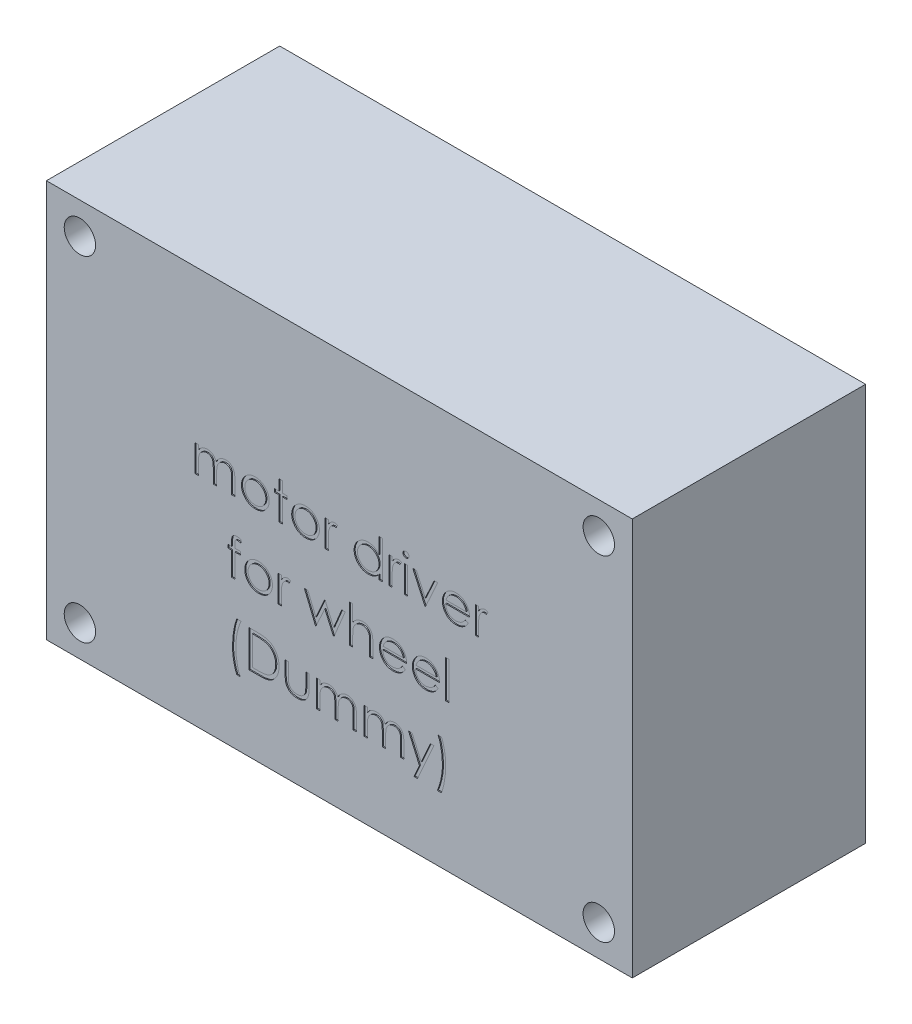
from build123d import *

# Parameters (mm, degrees)
SKETCH_1_W          = 56
SKETCH_1_H          = 38
EXTRUDE_1_DEPTH     = 22.3
SKETCH_2_R          = 1.5
CUT_EXTRUDE_1_DEPTH = 22.3
SKETCH_3_W          = 0.314102564
SKETCH_3_H          = 2.557692308
SKETCH_3_W_2        = 0.314102565
SKETCH_3_H_2        = 3.58974359
CUT_EXTRUDE_2_DEPTH = 0.1


with BuildPart() as part:
    # 스케치1 → 보스-돌출1 (new body)
    with BuildSketch(Plane.XY):
        Rectangle(SKETCH_1_W, SKETCH_1_H)
    extrude(amount=EXTRUDE_1_DEPTH)

    # 스케치2 → 컷-돌출1 (cut)
    with BuildSketch(Plane(origin=(0, 0, 0), x_dir=(-1, 0, 0), z_dir=(0, 0, -1))):
        with Locations((-24.8, 16)):
            Circle(SKETCH_2_R)
        with Locations((24.8, 16)):
            Circle(SKETCH_2_R)
        with Locations((24.8, -16)):
            Circle(SKETCH_2_R)
        with Locations((-24.8, -16)):
            Circle(SKETCH_2_R)
    extrude(amount=-CUT_EXTRUDE_1_DEPTH, mode=Mode.SUBTRACT)

    # 스케치3 → 컷-돌출2 (cut)
    # profile 1 of 27: a face of its own
    with BuildSketch(Plane.XY.offset(22.3)):
        with BuildLine():
            Line((-13.798076923, 4.417344576), (-13.483974359, 4.417344576))
            Line((-13.483974359, 4.417344576), (-13.483974359, 3.972833358))
            add(Edge.make_bspline(
                [(-13.483974359, 3.972833358), (-13.455690409, 4.01172096), (-13.401495649, 4.086233333), (-13.312629997, 4.184423617), (-13.223853884, 4.267751772), (-13.159920503, 4.311494644), (-13.129206731, 4.332508839)],
                knots=[0, 0, 0, 0, 1.134379233, 2.173579362, 3.122582517, 4, 4, 4, 4], degree=3))
            add(Edge.make_bspline(
                [(-13.129206731, 4.332508839), (-13.087342069, 4.352514204), (-13.004344169, 4.392175418), (-12.872924944, 4.432408977), (-12.738450274, 4.457134078), (-12.64764206, 4.460515451), (-12.601963141, 4.462216371)],
                knots=[0, 0, 0, 0, 1.014936303, 2.012140481, 3.000054389, 4, 4, 4, 4], degree=3))
            add(Edge.make_bspline(
                [(-12.601963141, 4.462216371), (-12.571070144, 4.46117108), (-12.509934565, 4.459102506), (-12.419350475, 4.445642471), (-12.331491863, 4.422376298), (-12.246877834, 4.389968974), (-12.167157155, 4.350722287), (-12.094067957, 4.304672579), (-12.028443749, 4.252975504), (-11.970317698, 4.193296571), (-11.918048672, 4.123959972), (-11.869969826, 4.043095723), (-11.825544613, 3.948888062), (-11.800923304, 3.880521521), (-11.787960737, 3.84452807)],
                knots=[0, 0, 0, 0, 1.009824226, 1.998387844, 2.986035974, 3.974953746, 4.955485308, 5.885931332, 6.793869504, 7.679848016, 8.601185859, 9.625726857, 10.749998409, 12, 12, 12, 12], degree=3))
            add(Edge.make_bspline(
                [(-11.787960737, 3.84452807), (-11.774249486, 3.869252489), (-11.747267669, 3.917906674), (-11.701962032, 3.986764936), (-11.654494235, 4.051171728), (-11.604459742, 4.111178152), (-11.552035155, 4.166487883), (-11.496973755, 4.217283785), (-11.439588974, 4.263783998), (-11.359796734, 4.318107158), (-11.255984126, 4.375808339), (-11.125096012, 4.425836783), (-10.98894584, 4.456752911), (-10.896528142, 4.460383184), (-10.849859776, 4.462216371)],
                knots=[0, 0, 0, 0, 0.86119277, 1.694706429, 2.50939023, 3.298075842, 4.073795165, 4.829715201, 5.57930267, 6.321991688, 7.768977793, 9.186738141, 10.579381044, 12, 12, 12, 12], degree=3))
            add(Edge.make_bspline(
                [(-10.849859776, 4.462216371), (-10.806978313, 4.46059915), (-10.723055127, 4.457434092), (-10.600877861, 4.432580619), (-10.486936056, 4.389902971), (-10.381458979, 4.331669335), (-10.286299166, 4.258490152), (-10.203582857, 4.171421314), (-10.133812493, 4.071078691), (-10.088233854, 3.976686702), (-10.05731859, 3.893351369), (-10.038257355, 3.822345078), (-10.02141766, 3.744193525), (-10.007436415, 3.658803264), (-9.997217863, 3.565872655), (-9.989647147, 3.46555378), (-9.984523074, 3.357768668), (-9.984161001, 3.283403168), (-9.983974359, 3.245068935)],
                knots=[0, 0, 0, 0, 1.209669288, 2.367440248, 3.500751976, 4.631527125, 5.755587489, 6.87532382, 8.007944318, 9.190864318, 9.82315674, 10.514484317, 11.263564316, 12.079023757, 12.955305781, 13.901327259, 14.918167583, 16, 16, 16, 16], degree=3))
            Line((-9.983974359, 3.245068935), (-9.983974359, 1.859652268))
            Line((-9.983974359, 1.859652268), (-10.298076923, 1.859652268))
            Line((-10.298076923, 1.859652268), (-10.298076923, 3.246471179))
            add(Edge.make_bspline(
                [(-10.298076923, 3.246471179), (-10.298154806, 3.279191753), (-10.298304485, 3.34207572), (-10.300998117, 3.432328171), (-10.306073431, 3.514596528), (-10.31200807, 3.588768616), (-10.320251879, 3.655017405), (-10.330897811, 3.713209823), (-10.342175491, 3.763803635), (-10.360911482, 3.819889682), (-10.390859373, 3.881759893), (-10.436476853, 3.948483468), (-10.49394696, 4.006564269), (-10.560307116, 4.056982585), (-10.635855561, 4.097976227), (-10.719120284, 4.127252236), (-10.809584336, 4.145375115), (-10.872207124, 4.14718113), (-10.904547276, 4.148113807)],
                knots=[0, 0, 0, 0, 1.253487763, 2.409012846, 3.458416907, 4.410876679, 5.259312806, 6.014470957, 6.676830364, 7.243083969, 8.276244668, 9.299465089, 10.325150304, 11.392391894, 12.482080715, 13.603491619, 14.762376348, 16, 16, 16, 16], degree=3))
            add(Edge.make_bspline(
                [(-10.904547276, 4.148113807), (-10.94421723, 4.14669765), (-11.022620141, 4.143898784), (-11.137065627, 4.115324911), (-11.247036644, 4.072244661), (-11.349251777, 4.009812203), (-11.443279568, 3.93500384), (-11.524179145, 3.846054244), (-11.591011331, 3.745424317), (-11.636265307, 3.652277615), (-11.664854608, 3.568608171), (-11.683731524, 3.495510799), (-11.698414915, 3.412429231), (-11.712185445, 3.31992174), (-11.721173173, 3.21735156), (-11.729341545, 3.105193159), (-11.733162408, 2.983109199), (-11.733696866, 2.898482511), (-11.733974359, 2.854544095)],
                knots=[0, 0, 0, 0, 1.090531906, 2.155305635, 3.229839962, 4.33261226, 5.44038871, 6.529323825, 7.629011124, 8.757537029, 9.370236727, 10.061839251, 10.834451254, 11.692844982, 12.636905849, 13.66920014, 14.789842145, 16, 16, 16, 16], degree=3))
            Line((-11.733974359, 2.854544095), (-11.733974359, 1.859652268))
            Line((-11.733974359, 1.859652268), (-12.048076923, 1.859652268))
            Line((-12.048076923, 1.859652268), (-12.048076923, 3.160233198))
            add(Edge.make_bspline(
                [(-12.048076923, 3.160233198), (-12.048156354, 3.196926517), (-12.048309171, 3.267520774), (-12.050985489, 3.368754449), (-12.05607211, 3.460835529), (-12.061952659, 3.543656993), (-12.070412837, 3.617068322), (-12.080022599, 3.68146308), (-12.09137121, 3.736679831), (-12.110161094, 3.797243216), (-12.138875563, 3.863964139), (-12.185063825, 3.93510516), (-12.242671405, 3.997373258), (-12.310242281, 4.050532006), (-12.386247963, 4.094473487), (-12.470231364, 4.126133239), (-12.561436277, 4.144557529), (-12.624313983, 4.146906025), (-12.656650641, 4.148113807)],
                knots=[0, 0, 0, 0, 1.320475261, 2.540461679, 3.643808994, 4.639130445, 5.527981419, 6.302341397, 6.981980563, 7.553956391, 8.582137848, 9.585246428, 10.591171744, 11.620968678, 12.668337649, 13.738356861, 14.836885341, 16, 16, 16, 16], degree=3))
            add(Edge.make_bspline(
                [(-12.656650641, 4.148113807), (-12.694666852, 4.146583347), (-12.770431812, 4.143533194), (-12.881733782, 4.116078921), (-12.989219465, 4.073074846), (-13.091174164, 4.013415027), (-13.184848312, 3.939515948), (-13.26685658, 3.852601052), (-13.335799105, 3.753752019), (-13.38153092, 3.661587502), (-13.411029394, 3.580014227), (-13.430624729, 3.51066328), (-13.447464355, 3.433663032), (-13.459978376, 3.34877592), (-13.472058792, 3.256554826), (-13.477889101, 3.156540337), (-13.483560663, 3.048818249), (-13.483833078, 2.974445704), (-13.483974359, 2.935874224)],
                knots=[0, 0, 0, 0, 1.098833095, 2.189935336, 3.297829714, 4.440610912, 5.596351641, 6.740013378, 7.886572111, 9.072425424, 9.705826452, 10.395263256, 11.156850408, 11.985370555, 12.878090359, 13.847760091, 14.883794034, 16, 16, 16, 16], degree=3))
            Line((-13.483974359, 2.935874224), (-13.483974359, 1.859652268))
            Line((-13.483974359, 1.859652268), (-13.798076923, 1.859652268))
            Line((-13.798076923, 1.859652268), (-13.798076923, 4.417344576))
        make_face()
    # profile 2 of 27: a face of its own
    with BuildSketch(Plane.XY.offset(22.3)):
        with BuildLine():
            add(Edge.make_bspline(
                [(-8.030649038, 4.462216371), (-7.982657766, 4.46119448), (-7.888558608, 4.459190801), (-7.750750722, 4.437775835), (-7.619205586, 4.405028471), (-7.493419394, 4.359756909), (-7.375003099, 4.299074958), (-7.262231855, 4.226665667), (-7.155414846, 4.140883074), (-7.091391816, 4.074525005), (-7.058894231, 4.040842172)],
                knots=[0, 0, 0, 0, 1.054011418, 2.066658804, 3.057071809, 4.030435133, 4.997543892, 5.974964718, 6.972108034, 8, 8, 8, 8], degree=3))
            add(Edge.make_bspline(
                [(-7.058894231, 4.040842172), (-7.030912277, 4.008628187), (-6.975489896, 3.944823644), (-6.904424178, 3.841368031), (-6.843202618, 3.734227931), (-6.794139657, 3.621980604), (-6.755454633, 3.505605933), (-6.727988937, 3.384703922), (-6.711652002, 3.259541575), (-6.709449035, 3.174537737), (-6.708333333, 3.131487204)],
                knots=[0, 0, 0, 0, 1.025258237, 2.030674902, 3.01204498, 3.988269485, 4.97094183, 5.956517959, 6.965070386, 8, 8, 8, 8], degree=3))
            add(Edge.make_bspline(
                [(-6.708333333, 3.131487204), (-6.709314671, 3.088187147), (-6.711253839, 3.002624213), (-6.729597455, 2.876604848), (-6.758128541, 2.754410025), (-6.798960379, 2.636551331), (-6.851318489, 2.522668504), (-6.915209176, 2.413258954), (-6.991080793, 2.308106821), (-7.07708479, 2.208104983), (-7.172136666, 2.115938768), (-7.275252815, 2.035610499), (-7.384406848, 1.966788974), (-7.501050202, 1.911352559), (-7.624117688, 1.867642858), (-7.753874757, 1.836942842), (-7.890119827, 1.818381158), (-7.983147048, 1.815997585), (-8.030649038, 1.814780474)],
                knots=[0, 0, 0, 0, 0.998656419, 1.973391657, 2.932242238, 3.890759089, 4.846373663, 5.82037756, 6.809684879, 7.83454468, 8.860553229, 9.859544525, 10.845671541, 11.83227036, 12.833544569, 13.85385346, 14.904124723, 16, 16, 16, 16], degree=3))
            add(Edge.make_bspline(
                [(-8.030649038, 1.814780474), (-8.078383758, 1.81600167), (-8.171874618, 1.818393444), (-8.3086006, 1.836870727), (-8.438590219, 1.86762871), (-8.561818817, 1.911496202), (-8.678963664, 1.966790746), (-8.788750161, 2.035402436), (-8.891950076, 2.115962591), (-8.987022061, 2.208098528), (-9.073020666, 2.308108484), (-9.148893675, 2.413258523), (-9.212784001, 2.522668616), (-9.265142205, 2.636551301), (-9.305974018, 2.754410033), (-9.33450511, 2.876604845), (-9.352848725, 3.002624214), (-9.354787893, 3.088187147), (-9.355769231, 3.131487204)],
                knots=[0, 0, 0, 0, 1.099876186, 2.154163076, 3.173186993, 4.173200201, 5.163417411, 6.152872554, 7.150605724, 8.17532212, 9.198891216, 10.186952605, 11.159729845, 12.11414092, 13.071450619, 14.029093627, 15.002601286, 16, 16, 16, 16], degree=3))
            add(Edge.make_bspline(
                [(-9.355769231, 3.131487204), (-9.35464592, 3.17430375), (-9.352421959, 3.259073153), (-9.33610145, 3.384000213), (-9.308742893, 3.504697602), (-9.270011497, 3.620623078), (-9.220496306, 3.732378514), (-9.160135018, 3.839783345), (-9.088344386, 3.942771146), (-9.033142434, 4.006493226), (-9.005208333, 4.038738807)],
                knots=[0, 0, 0, 0, 1.031353054, 2.041901799, 3.029428768, 4.008703097, 4.981709435, 5.96992636, 6.972712378, 8, 8, 8, 8], degree=3))
            add(Edge.make_bspline(
                [(-9.005208333, 4.038738807), (-8.972759742, 4.072713746), (-8.908943878, 4.139531442), (-8.801595151, 4.225063966), (-8.68910133, 4.29898004), (-8.569376403, 4.358456256), (-8.443693546, 4.405294774), (-8.311474303, 4.437860289), (-8.173198788, 4.459113644), (-8.078639166, 4.461171821), (-8.030649038, 4.462216371)],
                knots=[0, 0, 0, 0, 1.027980169, 2.021703884, 2.998553061, 3.971491411, 4.943284454, 5.930300938, 6.949603206, 8, 8, 8, 8], degree=3))
        make_face()
        with BuildLine():
            add(Edge.make_bspline(
                [(-8.032051282, 4.148113807), (-8.065988893, 4.147149215), (-8.132988022, 4.145244933), (-8.231607607, 4.130761028), (-8.326547761, 4.107813524), (-8.417988605, 4.075209468), (-8.505621777, 4.033110569), (-8.58953118, 3.981402209), (-8.66996362, 3.920769252), (-8.745345683, 3.85130658), (-8.814527995, 3.775427586), (-8.875005972, 3.694579227), (-8.926431078, 3.610072881), (-8.969271237, 3.52182067), (-9.001178425, 3.428928256), (-9.024351448, 3.332447624), (-9.038821688, 3.232182208), (-9.040708067, 3.16402119), (-9.041666667, 3.129383839)],
                knots=[0, 0, 0, 0, 1.021534396, 2.016698045, 2.994645724, 3.958388632, 4.93408049, 5.916473867, 6.921342795, 7.962252576, 8.998418191, 10.008913653, 10.997312074, 11.973003931, 12.956656626, 13.948281152, 14.957379055, 16, 16, 16, 16], degree=3))
            add(Edge.make_bspline(
                [(-9.041666667, 3.129383839), (-9.040059843, 3.084631812), (-9.036870599, 2.995807406), (-9.010935362, 2.864996284), (-8.967549082, 2.739414432), (-8.908961803, 2.619798046), (-8.835555584, 2.509125767), (-8.749068517, 2.410454283), (-8.650428817, 2.325268472), (-8.540812317, 2.254587626), (-8.422457999, 2.19842787), (-8.297201678, 2.158628895), (-8.166560984, 2.132757202), (-8.077280252, 2.130185728), (-8.032051282, 2.128883038)],
                knots=[0, 0, 0, 0, 1.016792936, 2.018143844, 3.017858371, 4.030088057, 5.03801393, 6.028138512, 7.003788237, 7.991172063, 8.984598303, 9.972568034, 10.972917682, 12, 12, 12, 12], degree=3))
            add(Edge.make_bspline(
                [(-8.032051282, 2.128883038), (-7.986824913, 2.130193318), (-7.897549317, 2.132779775), (-7.76709014, 2.158498595), (-7.642176168, 2.198602255), (-7.523944781, 2.254524465), (-7.414378177, 2.32553688), (-7.315029056, 2.409973257), (-7.229280445, 2.509387108), (-7.15594684, 2.619944637), (-7.096400097, 2.739228989), (-7.053216896, 2.865019462), (-7.02721931, 2.995801503), (-7.024038481, 3.084629834), (-7.022435897, 3.129383839)],
                knots=[0, 0, 0, 0, 1.02726834, 2.027799167, 3.010890988, 4.004497153, 4.992059811, 5.971914811, 6.958719428, 7.966827853, 8.981595046, 9.981490638, 10.983022906, 12, 12, 12, 12], degree=3))
            add(Edge.make_bspline(
                [(-7.022435897, 3.129383839), (-7.023394167, 3.164021397), (-7.025279897, 3.232182822), (-7.039754861, 3.332445276), (-7.062910401, 3.428936873), (-7.094882018, 3.521788876), (-7.137536032, 3.61030138), (-7.189952825, 3.694331107), (-7.25018385, 3.775707653), (-7.320200971, 3.851061294), (-7.395504349, 3.920796331), (-7.475969387, 3.98142572), (-7.559754366, 4.032883316), (-7.647132948, 4.075569556), (-7.738585516, 4.107516896), (-7.833392645, 4.130893528), (-7.931591455, 4.145183725), (-7.998350498, 4.147130866), (-8.032051282, 4.148113807)],
                knots=[0, 0, 0, 0, 1.042956736, 2.052379634, 3.044323526, 4.02829302, 5.004299113, 5.996692471, 7.007513377, 8.048758398, 9.090003419, 10.095195979, 11.07790575, 12.047570684, 13.018257071, 13.989683339, 14.985167495, 16, 16, 16, 16], degree=3))
        make_face(mode=Mode.SUBTRACT)
    # profile 3 of 27: a face of its own
    with BuildSketch(Plane.XY.offset(22.3)):
        Polygon((-5.766025641, 5.449395858), (-5.451923077, 5.449395858), (-5.451923077, 4.417344576), (-5.003205128, 4.417344576), (-5.003205128, 4.103242012), (-5.451923077, 4.103242012), (-5.451923077, 1.859652268), (-5.766025641, 1.859652268), (-5.766025641, 4.103242012), (-6.21474359, 4.103242012), (-6.21474359, 4.417344576), (-5.766025641, 4.417344576), align=None)
    # profile 4 of 27: a face of its own
    with BuildSketch(Plane.XY.offset(22.3)):
        with BuildLine():
            add(Edge.make_bspline(
                [(-3.229366987, 4.462216371), (-3.181375714, 4.46119448), (-3.087276557, 4.459190801), (-2.949468671, 4.437775835), (-2.817923535, 4.405028471), (-2.692137343, 4.359756909), (-2.573721047, 4.299074958), (-2.460949803, 4.226665667), (-2.354132794, 4.140883074), (-2.290109765, 4.074525005), (-2.257612179, 4.040842172)],
                knots=[0, 0, 0, 0, 1.054011418, 2.066658804, 3.057071809, 4.030435133, 4.997543892, 5.974964718, 6.972108034, 8, 8, 8, 8], degree=3))
            add(Edge.make_bspline(
                [(-2.257612179, 4.040842172), (-2.229630225, 4.008628187), (-2.174207845, 3.944823644), (-2.103142126, 3.841368031), (-2.041920566, 3.734227931), (-1.992857605, 3.621980604), (-1.954172582, 3.505605933), (-1.926706885, 3.384703922), (-1.91036995, 3.259541575), (-1.908166983, 3.174537737), (-1.907051282, 3.131487204)],
                knots=[0, 0, 0, 0, 1.025258237, 2.030674902, 3.01204498, 3.988269485, 4.97094183, 5.956517959, 6.965070386, 8, 8, 8, 8], degree=3))
            add(Edge.make_bspline(
                [(-1.907051282, 3.131487204), (-1.908032619, 3.088187147), (-1.909971788, 3.002624213), (-1.928315404, 2.876604848), (-1.95684649, 2.754410025), (-1.997678328, 2.636551331), (-2.050036437, 2.522668504), (-2.113927125, 2.413258954), (-2.189798742, 2.308106821), (-2.275802739, 2.208104983), (-2.370854615, 2.115938768), (-2.473970763, 2.035610499), (-2.583124797, 1.966788974), (-2.69976815, 1.911352559), (-2.822835637, 1.867642858), (-2.952592705, 1.836942842), (-3.088837776, 1.818381158), (-3.181864997, 1.815997585), (-3.229366987, 1.814780474)],
                knots=[0, 0, 0, 0, 0.998656419, 1.973391657, 2.932242238, 3.890759089, 4.846373663, 5.82037756, 6.809684879, 7.83454468, 8.860553229, 9.859544525, 10.845671541, 11.83227036, 12.833544569, 13.85385346, 14.904124723, 16, 16, 16, 16], degree=3))
            add(Edge.make_bspline(
                [(-3.229366987, 1.814780474), (-3.277101707, 1.81600167), (-3.370592566, 1.818393444), (-3.507318548, 1.836870727), (-3.637308167, 1.86762871), (-3.760536766, 1.911496202), (-3.877681613, 1.966790746), (-3.98746811, 2.035402436), (-4.090668025, 2.115962591), (-4.18574001, 2.208098528), (-4.271738615, 2.308108484), (-4.347611623, 2.413258523), (-4.411501949, 2.522668616), (-4.463860153, 2.636551301), (-4.504691966, 2.754410033), (-4.533223059, 2.876604845), (-4.551566673, 3.002624214), (-4.553505842, 3.088187147), (-4.554487179, 3.131487204)],
                knots=[0, 0, 0, 0, 1.099876186, 2.154163076, 3.173186993, 4.173200201, 5.163417411, 6.152872554, 7.150605724, 8.17532212, 9.198891216, 10.186952605, 11.159729845, 12.11414092, 13.071450619, 14.029093627, 15.002601286, 16, 16, 16, 16], degree=3))
            add(Edge.make_bspline(
                [(-4.554487179, 3.131487204), (-4.553363869, 3.17430375), (-4.551139908, 3.259073153), (-4.534819399, 3.384000213), (-4.507460842, 3.504697602), (-4.468729446, 3.620623078), (-4.419214255, 3.732378514), (-4.358852967, 3.839783345), (-4.287062334, 3.942771146), (-4.231860383, 4.006493226), (-4.203926282, 4.038738807)],
                knots=[0, 0, 0, 0, 1.031353054, 2.041901799, 3.029428768, 4.008703097, 4.981709435, 5.96992636, 6.972712378, 8, 8, 8, 8], degree=3))
            add(Edge.make_bspline(
                [(-4.203926282, 4.038738807), (-4.171477691, 4.072713746), (-4.107661827, 4.139531442), (-4.000313099, 4.225063966), (-3.887819278, 4.29898004), (-3.768094352, 4.358456256), (-3.642411494, 4.405294774), (-3.510192252, 4.437860289), (-3.371916736, 4.459113644), (-3.277357115, 4.461171821), (-3.229366987, 4.462216371)],
                knots=[0, 0, 0, 0, 1.027980169, 2.021703884, 2.998553061, 3.971491411, 4.943284454, 5.930300938, 6.949603206, 8, 8, 8, 8], degree=3))
        make_face()
        with BuildLine():
            add(Edge.make_bspline(
                [(-3.230769231, 4.148113807), (-3.264706842, 4.147149215), (-3.331705971, 4.145244933), (-3.430325555, 4.130761028), (-3.525265709, 4.107813524), (-3.616706554, 4.075209468), (-3.704339726, 4.033110569), (-3.788249128, 3.981402209), (-3.868681568, 3.920769252), (-3.944063632, 3.85130658), (-4.013245944, 3.775427586), (-4.07372392, 3.694579227), (-4.125149027, 3.610072881), (-4.167989186, 3.52182067), (-4.199896374, 3.428928256), (-4.223069396, 3.332447624), (-4.237539637, 3.232182208), (-4.239426015, 3.16402119), (-4.240384615, 3.129383839)],
                knots=[0, 0, 0, 0, 1.021534396, 2.016698045, 2.994645724, 3.958388632, 4.93408049, 5.916473867, 6.921342795, 7.962252576, 8.998418191, 10.008913653, 10.997312074, 11.973003931, 12.956656626, 13.948281152, 14.957379055, 16, 16, 16, 16], degree=3))
            add(Edge.make_bspline(
                [(-4.240384615, 3.129383839), (-4.238777792, 3.084631812), (-4.235588547, 2.995807406), (-4.209653311, 2.864996284), (-4.166267031, 2.739414432), (-4.107679751, 2.619798046), (-4.034273533, 2.509125767), (-3.947786466, 2.410454283), (-3.849146766, 2.325268472), (-3.739530265, 2.254587626), (-3.621175947, 2.19842787), (-3.495919626, 2.158628895), (-3.365278932, 2.132757202), (-3.275998201, 2.130185728), (-3.230769231, 2.128883038)],
                knots=[0, 0, 0, 0, 1.016792936, 2.018143844, 3.017858371, 4.030088057, 5.03801393, 6.028138512, 7.003788237, 7.991172063, 8.984598303, 9.972568034, 10.972917682, 12, 12, 12, 12], degree=3))
            add(Edge.make_bspline(
                [(-3.230769231, 2.128883038), (-3.185542862, 2.130193318), (-3.096267266, 2.132779775), (-2.965808089, 2.158498595), (-2.840894117, 2.198602255), (-2.72266273, 2.254524465), (-2.613096126, 2.32553688), (-2.513747005, 2.409973257), (-2.427998394, 2.509387108), (-2.354664789, 2.619944637), (-2.295118046, 2.739228989), (-2.251934844, 2.865019462), (-2.225937258, 2.995801503), (-2.22275643, 3.084629834), (-2.221153846, 3.129383839)],
                knots=[0, 0, 0, 0, 1.02726834, 2.027799167, 3.010890988, 4.004497153, 4.992059811, 5.971914811, 6.958719428, 7.966827853, 8.981595046, 9.981490638, 10.983022906, 12, 12, 12, 12], degree=3))
            add(Edge.make_bspline(
                [(-2.221153846, 3.129383839), (-2.222112116, 3.164021397), (-2.223997845, 3.232182822), (-2.23847281, 3.332445276), (-2.261628349, 3.428936873), (-2.293599967, 3.521788876), (-2.33625398, 3.61030138), (-2.388670774, 3.694331107), (-2.448901799, 3.775707653), (-2.51891892, 3.851061294), (-2.594222298, 3.920796331), (-2.674687336, 3.98142572), (-2.758472314, 4.032883316), (-2.845850897, 4.075569556), (-2.937303465, 4.107516896), (-3.032110594, 4.130893528), (-3.130309404, 4.145183725), (-3.197068447, 4.147130866), (-3.230769231, 4.148113807)],
                knots=[0, 0, 0, 0, 1.042956736, 2.052379634, 3.044323526, 4.02829302, 5.004299113, 5.996692471, 7.007513377, 8.048758398, 9.090003419, 10.095195979, 11.07790575, 12.047570684, 13.018257071, 13.989683339, 14.985167495, 16, 16, 16, 16], degree=3))
        make_face(mode=Mode.SUBTRACT)
    # profile 5 of 27: a face of its own
    with BuildSketch(Plane.XY.offset(22.3)):
        with BuildLine():
            Line((-1.368589744, 4.417344576), (-1.054487179, 4.417344576))
            Line((-1.054487179, 4.417344576), (-1.054487179, 4.040842172))
            add(Edge.make_bspline(
                [(-1.054487179, 4.040842172), (-1.031298421, 4.075898001), (-0.9869501, 4.142942), (-0.91323717, 4.231611301), (-0.837733839, 4.305026348), (-0.760078652, 4.363529866), (-0.679700552, 4.407342985), (-0.5983636, 4.43943602), (-0.51478813, 4.458413335), (-0.458626206, 4.460946994), (-0.430488782, 4.462216371)],
                knots=[0, 0, 0, 0, 1.2804753, 2.448899062, 3.506932113, 4.484331642, 5.4025378, 6.288909075, 7.142734305, 8, 8, 8, 8], degree=3))
            add(Edge.make_bspline(
                [(-0.430488782, 4.462216371), (-0.408662456, 4.461025844), (-0.36375337, 4.458576259), (-0.295770781, 4.441365434), (-0.225727329, 4.413887411), (-0.180584941, 4.388047189), (-0.157051282, 4.374576147)],
                knots=[0, 0, 0, 0, 0.901110191, 1.854092781, 2.881294221, 4, 4, 4, 4], degree=3))
            Line((-0.157051282, 4.374576147), (-0.329527244, 4.10254089))
            add(Edge.make_bspline(
                [(-0.329527244, 4.10254089), (-0.344636265, 4.109281156), (-0.373316079, 4.122075472), (-0.415270646, 4.137217482), (-0.453951982, 4.146133398), (-0.478595541, 4.147484115), (-0.490084135, 4.148113807)],
                knots=[0, 0, 0, 0, 1.180555205, 2.24091978, 3.179933427, 4, 4, 4, 4], degree=3))
            add(Edge.make_bspline(
                [(-0.490084135, 4.148113807), (-0.515289868, 4.14643377), (-0.566702258, 4.14300698), (-0.642186758, 4.116068173), (-0.715433963, 4.072542932), (-0.773605625, 4.024271821), (-0.818647878, 3.977724023), (-0.850788104, 3.937075621), (-0.880270851, 3.891496989), (-0.908441071, 3.841767305), (-0.934107365, 3.787037459), (-0.958062035, 3.727854246), (-0.979720897, 3.664149117), (-0.992071142, 3.619766597), (-0.998397436, 3.597032076)],
                knots=[0, 0, 0, 0, 1.125678352, 2.296057538, 3.5422874, 4.923748041, 5.663163013, 6.437101912, 7.23742474, 8.08941207, 8.991984279, 9.93940061, 10.944477711, 12, 12, 12, 12], degree=3))
            add(Edge.make_bspline(
                [(-0.998397436, 3.597032076), (-1.003129829, 3.576754903), (-1.013611721, 3.531842504), (-1.023803259, 3.456493979), (-1.033872777, 3.36747032), (-1.040969395, 3.264523728), (-1.047547437, 3.147911284), (-1.051257519, 3.017455338), (-1.05436066, 2.873021987), (-1.054443727, 2.772047634), (-1.054487179, 2.719227589)],
                knots=[0, 0, 0, 0, 0.566838948, 1.255505196, 2.06880316, 3.007127437, 4.065329342, 5.249902469, 6.561414163, 8, 8, 8, 8], degree=3))
            Line((-1.054487179, 2.719227589), (-1.054487179, 1.859652268))
            Line((-1.054487179, 1.859652268), (-1.368589744, 1.859652268))
            Line((-1.368589744, 1.859652268), (-1.368589744, 4.417344576))
        make_face()
    # profile 6 of 27: a face of its own
    with BuildSketch(Plane.XY.offset(22.3)):
        with BuildLine():
            Line((4.105769231, 5.449395858), (4.105769231, 1.859652268))
            Line((4.105769231, 1.859652268), (3.791666667, 1.859652268))
            Line((3.791666667, 1.859652268), (3.791666667, 2.302060121))
            add(Edge.make_bspline(
                [(3.791666667, 2.302060121), (3.756247876, 2.262020527), (3.687127661, 2.183882756), (3.571686543, 2.081800584), (3.449318365, 1.997422262), (3.320617044, 1.929272346), (3.1856988, 1.87808029), (3.044862713, 1.841694131), (2.898051332, 1.818300296), (2.797798977, 1.815964274), (2.746995192, 1.814780474)],
                knots=[0, 0, 0, 0, 1.074387032, 2.096679803, 3.090159297, 4.057316773, 5.018401886, 5.985159533, 6.978961417, 8, 8, 8, 8], degree=3))
            add(Edge.make_bspline(
                [(2.746995192, 1.814780474), (2.701827238, 1.816006846), (2.612754034, 1.818425306), (2.481724956, 1.83718761), (2.355632707, 1.867318232), (2.234358134, 1.909219121), (2.118685989, 1.964799943), (2.007625892, 2.031341191), (1.9017532, 2.110582021), (1.802681661, 2.201170049), (1.711449661, 2.299565036), (1.631388388, 2.404510583), (1.564635308, 2.515552887), (1.508815228, 2.631286041), (1.465818883, 2.752600961), (1.435845249, 2.879078128), (1.417104802, 3.010568002), (1.414687342, 3.100107525), (1.413461538, 3.14550964)],
                knots=[0, 0, 0, 0, 1.033919861, 2.038935746, 3.024066025, 3.998881131, 4.97069526, 5.957263378, 6.95902576, 7.993208707, 9.027059324, 10.027763471, 11.009749337, 11.988697705, 12.965288445, 13.950418724, 14.960734635, 16, 16, 16, 16], degree=3))
            add(Edge.make_bspline(
                [(1.413461538, 3.14550964), (1.41471451, 3.189973344), (1.417191567, 3.277875687), (1.435644787, 3.407154385), (1.466675795, 3.531672646), (1.510223643, 3.651029589), (1.566065598, 3.765369639), (1.633993685, 3.874773664), (1.71401281, 3.979543062), (1.806265217, 4.077214289), (1.906199987, 4.167434903), (2.013108718, 4.245843948), (2.124331999, 4.313560797), (2.241595009, 4.367214273), (2.363162114, 4.410623378), (2.49011556, 4.440656346), (2.621927139, 4.458353667), (2.711417631, 4.460916431), (2.756810897, 4.462216371)],
                knots=[0, 0, 0, 0, 1.020392517, 2.01726096, 2.990465484, 3.961182959, 4.928053699, 5.906110375, 6.912531644, 7.948652711, 8.985773172, 9.998621852, 10.987621588, 11.969261332, 12.953316658, 13.946091881, 14.958173133, 16, 16, 16, 16], degree=3))
            add(Edge.make_bspline(
                [(2.756810897, 4.462216371), (2.809027705, 4.460649275), (2.911523496, 4.45757324), (3.061422017, 4.431866873), (3.203209628, 4.388703995), (3.337702615, 4.329612714), (3.464099176, 4.252811962), (3.583325816, 4.160060514), (3.693309139, 4.048733368), (3.758380962, 3.965121795), (3.791666667, 3.922352589)],
                knots=[0, 0, 0, 0, 1.031072012, 2.023879775, 2.993683497, 3.952812103, 4.918022106, 5.908088563, 6.929940113, 8, 8, 8, 8], degree=3))
            Line((3.791666667, 3.922352589), (3.791666667, 5.449395858))
            Line((3.791666667, 5.449395858), (4.105769231, 5.449395858))
        make_face()
        with BuildLine():
            add(Edge.make_bspline(
                [(2.761017628, 4.148113807), (2.71510329, 4.146480169), (2.62447569, 4.143255628), (2.491431688, 4.118082133), (2.364118274, 4.076197539), (2.2431722, 4.018915637), (2.130503983, 3.946886901), (2.029810312, 3.859765518), (1.940267611, 3.759928503), (1.864959347, 3.647826393), (1.80356885, 3.527648302), (1.760401818, 3.402023864), (1.731932571, 3.273218886), (1.72902405, 3.1858562), (1.727564103, 3.142004031)],
                knots=[0, 0, 0, 0, 1.031046209, 2.035121221, 3.029706178, 4.034933723, 5.034054252, 6.02443088, 7.017295772, 8.038157696, 9.050218397, 10.03989886, 11.016116709, 12, 12, 12, 12], degree=3))
            add(Edge.make_bspline(
                [(1.727564103, 3.142004031), (1.729428996, 3.098413924), (1.733151473, 3.011404568), (1.759902167, 2.882423991), (1.804782041, 2.756769949), (1.866024103, 2.635508956), (1.942710728, 2.522924856), (2.031599381, 2.421184733), (2.133549662, 2.333695145), (2.246477169, 2.260457571), (2.367085139, 2.20129505), (2.493919071, 2.160129411), (2.624594709, 2.13355163), (2.713447043, 2.130447153), (2.758213141, 2.128883038)],
                knots=[0, 0, 0, 0, 0.979072187, 1.954306742, 2.945804271, 3.96968567, 4.997920485, 5.998718438, 6.996577872, 8.005894225, 9.015743152, 10.005417472, 10.995077863, 12, 12, 12, 12], degree=3))
            add(Edge.make_bspline(
                [(2.758213141, 2.128883038), (2.803659644, 2.130543002), (2.89404823, 2.133844505), (3.027486938, 2.159125771), (3.156981901, 2.200894569), (3.280769129, 2.258793696), (3.396085261, 2.330551052), (3.499583138, 2.414558143), (3.587099107, 2.512261327), (3.661291716, 2.61963778), (3.719467133, 2.737349776), (3.761843192, 2.862683967), (3.786897098, 2.995644715), (3.790054827, 3.086508642), (3.791666667, 3.132889448)],
                knots=[0, 0, 0, 0, 1.01762866, 2.023962475, 3.030623092, 4.058876274, 5.077231937, 6.066672613, 7.034107872, 8.005628644, 8.981990164, 9.965428785, 10.961468474, 12, 12, 12, 12], degree=3))
            add(Edge.make_bspline(
                [(3.791666667, 3.132889448), (3.79070701, 3.168227278), (3.788818103, 3.237783312), (3.774387533, 3.339910829), (3.751432607, 3.437644555), (3.719086437, 3.531087244), (3.676595152, 3.61972226), (3.625347387, 3.70418602), (3.564441937, 3.784039231), (3.494859241, 3.858182302), (3.418694038, 3.925808765), (3.338099498, 3.986173005), (3.252120751, 4.035761778), (3.162203714, 4.07680305), (3.068192379, 4.1094622), (2.969321759, 4.131249893), (2.866642773, 4.146210214), (2.796596717, 4.147472595), (2.761017628, 4.148113807)],
                knots=[0, 0, 0, 0, 1.050140795, 2.067009409, 3.05949893, 4.030605086, 5.00011959, 5.97591094, 6.962425594, 7.979863591, 8.993523472, 9.986985069, 10.967611495, 11.937549037, 12.921786183, 13.919465291, 14.943216303, 16, 16, 16, 16], degree=3))
        make_face(mode=Mode.SUBTRACT)
    # profile 7 of 27: a face of its own
    with BuildSketch(Plane.XY.offset(22.3)):
        with BuildLine():
            Line((4.733974359, 4.417344576), (5.048076923, 4.417344576))
            Line((5.048076923, 4.417344576), (5.048076923, 4.040842172))
            add(Edge.make_bspline(
                [(5.048076923, 4.040842172), (5.071265682, 4.075898001), (5.115614003, 4.142942), (5.189326932, 4.231611301), (5.264830263, 4.305026348), (5.342485451, 4.363529866), (5.422863551, 4.407342985), (5.504200502, 4.43943602), (5.587775972, 4.458413335), (5.643937896, 4.460946994), (5.672075321, 4.462216371)],
                knots=[0, 0, 0, 0, 1.2804753, 2.448899062, 3.506932113, 4.484331642, 5.4025378, 6.288909075, 7.142734305, 8, 8, 8, 8], degree=3))
            add(Edge.make_bspline(
                [(5.672075321, 4.462216371), (5.693901647, 4.461025844), (5.738810732, 4.458576259), (5.806793322, 4.441365434), (5.876836774, 4.413887411), (5.921979161, 4.388047189), (5.945512821, 4.374576147)],
                knots=[0, 0, 0, 0, 0.901110191, 1.854092781, 2.881294221, 4, 4, 4, 4], degree=3))
            Line((5.945512821, 4.374576147), (5.773036859, 4.10254089))
            add(Edge.make_bspline(
                [(5.773036859, 4.10254089), (5.757927838, 4.109281156), (5.729248023, 4.122075472), (5.687293457, 4.137217482), (5.64861212, 4.146133398), (5.623968562, 4.147484115), (5.612479968, 4.148113807)],
                knots=[0, 0, 0, 0, 1.180555205, 2.24091978, 3.179933427, 4, 4, 4, 4], degree=3))
            add(Edge.make_bspline(
                [(5.612479968, 4.148113807), (5.587274234, 4.14643377), (5.535861844, 4.14300698), (5.460377345, 4.116068173), (5.38713014, 4.072542932), (5.328958477, 4.024271821), (5.283916224, 3.977724023), (5.251775999, 3.937075621), (5.222293252, 3.891496989), (5.194123031, 3.841767305), (5.168456737, 3.787037459), (5.144502068, 3.727854246), (5.122843205, 3.664149117), (5.110492961, 3.619766597), (5.104166667, 3.597032076)],
                knots=[0, 0, 0, 0, 1.125678352, 2.296057538, 3.5422874, 4.923748041, 5.663163013, 6.437101912, 7.23742474, 8.08941207, 8.991984279, 9.93940061, 10.944477711, 12, 12, 12, 12], degree=3))
            add(Edge.make_bspline(
                [(5.104166667, 3.597032076), (5.099434273, 3.576754903), (5.088952382, 3.531842504), (5.078760844, 3.456493979), (5.068691326, 3.36747032), (5.061594707, 3.264523728), (5.055016665, 3.147911284), (5.051306583, 3.017455338), (5.048203443, 2.873021987), (5.048120376, 2.772047634), (5.048076923, 2.719227589)],
                knots=[0, 0, 0, 0, 0.566838948, 1.255505196, 2.06880316, 3.007127437, 4.065329342, 5.249902469, 6.561414163, 8, 8, 8, 8], degree=3))
            Line((5.048076923, 2.719227589), (5.048076923, 1.859652268))
            Line((5.048076923, 1.859652268), (4.733974359, 1.859652268))
            Line((4.733974359, 1.859652268), (4.733974359, 4.417344576))
        make_face()
    # profile 8 of 27: a face of its own
    with BuildSketch(Plane.XY.offset(22.3)):
        with BuildLine():
            add(Edge.make_bspline(
                [(6.370392628, 5.494267653), (6.389883944, 5.493363501), (6.428051684, 5.491592997), (6.483244952, 5.47643152), (6.533501964, 5.450731834), (6.578079696, 5.416252153), (6.616331583, 5.37570271), (6.643112294, 5.328441741), (6.66032469, 5.277383103), (6.662403245, 5.241768014), (6.663461538, 5.22363464)],
                knots=[0, 0, 0, 0, 1.055194115, 2.066272739, 3.074728998, 4.095836921, 5.109056067, 6.073838105, 7.019297344, 8, 8, 8, 8], degree=3))
            add(Edge.make_bspline(
                [(6.663461538, 5.22363464), (6.662379379, 5.205971987), (6.660240077, 5.171055012), (6.643125588, 5.12088154), (6.616103351, 5.074277257), (6.578104225, 5.033806546), (6.533495464, 4.999345926), (6.483246678, 4.973641187), (6.42805123, 4.95848105), (6.38988379, 4.956710361), (6.370392628, 4.955806115)],
                knots=[0, 0, 0, 0, 0.96129708, 1.900370562, 2.859976407, 3.87933698, 4.906634145, 5.921202961, 6.938410037, 8, 8, 8, 8], degree=3))
            add(Edge.make_bspline(
                [(6.370392628, 4.955806115), (6.351124353, 4.956675835), (6.313621173, 4.958368632), (6.259254331, 4.973938649), (6.209425841, 4.999354722), (6.164761168, 5.033580908), (6.127530975, 5.074525805), (6.10043265, 5.120853099), (6.083357688, 5.171062253), (6.081213059, 5.20597442), (6.080128205, 5.22363464)],
                knots=[0, 0, 0, 0, 1.054934014, 2.053291228, 3.073705704, 4.106921865, 5.123545215, 6.088680038, 7.033164197, 8, 8, 8, 8], degree=3))
            add(Edge.make_bspline(
                [(6.080128205, 5.22363464), (6.081189292, 5.24176549), (6.083273333, 5.277375622), (6.100445449, 5.328470655), (6.127305257, 5.375452157), (6.16478582, 5.416477657), (6.209419281, 5.450723091), (6.259256026, 5.476134073), (6.313620725, 5.491705412), (6.351124201, 5.493398027), (6.370392628, 5.494267653)],
                knots=[0, 0, 0, 0, 0.98631895, 1.937192651, 2.907499808, 3.917963147, 4.944918757, 5.95915025, 6.951458133, 8, 8, 8, 8], degree=3))
        make_face()
    # profile 9 of 27: a face of its own
    with BuildSketch(Plane.XY.offset(22.3)):
        with Locations((6.371794872, 3.138498422)):
            Rectangle(SKETCH_3_W, SKETCH_3_H)
    # profile 10 of 27: a face of its own
    with BuildSketch(Plane.XY.offset(22.3)):
        Polygon((7.022435897, 4.417344576), (7.362479968, 4.417344576), (8.211538462, 2.555165089), (9.060596955, 4.417344576), (9.400641026, 4.417344576), (8.233974359, 1.859652268), (8.189102564, 1.859652268), align=None)
    # profile 11 of 27: a face of its own
    with BuildSketch(Plane.XY.offset(22.3)):
        with BuildLine():
            Line((12.038261218, 2.667344576), (12.317307692, 2.520810121))
            add(Edge.make_bspline(
                [(12.317307692, 2.520810121), (12.295071097, 2.48136679), (12.251807489, 2.404625687), (12.177406741, 2.299193826), (12.099414668, 2.204346111), (12.0143107, 2.122616456), (11.924641021, 2.051365071), (11.829908366, 1.989027247), (11.729619549, 1.935908726), (11.623769824, 1.891156198), (11.511470273, 1.856746704), (11.392448756, 1.832442483), (11.266477261, 1.817419215), (11.180131081, 1.815674074), (11.135917468, 1.814780474)],
                knots=[0, 0, 0, 0, 1.120438281, 2.179929193, 3.190490725, 4.156257408, 5.095198341, 6.022838206, 6.959905092, 7.901321166, 8.864066838, 9.862729781, 10.905609505, 12, 12, 12, 12], degree=3))
            add(Edge.make_bspline(
                [(11.135917468, 1.814780474), (11.08677549, 1.815927649), (10.990913729, 1.818165456), (10.851373982, 1.83745792), (10.719994563, 1.868930279), (10.59678286, 1.91289582), (10.482040607, 1.970323144), (10.375539753, 2.040282626), (10.276720227, 2.122414881), (10.188696017, 2.217431324), (10.109452135, 2.319113282), (10.039526315, 2.425069166), (9.981068884, 2.535032391), (9.933516274, 2.648302915), (9.895111409, 2.764166808), (9.868344705, 2.883678276), (9.852914957, 3.00651386), (9.850550511, 3.089611196), (9.849358974, 3.131487204)],
                knots=[0, 0, 0, 0, 1.145258523, 2.234067595, 3.276747158, 4.290159414, 5.277019952, 6.260822364, 7.254936242, 8.264827045, 9.274100331, 10.257902744, 11.220704747, 12.172965371, 13.118907548, 14.062713208, 15.023725156, 16, 16, 16, 16], degree=3))
            add(Edge.make_bspline(
                [(9.849358974, 3.131487204), (9.850418116, 3.170782035), (9.852517194, 3.248659199), (9.865747981, 3.363924744), (9.889196274, 3.475953197), (9.921372598, 3.584837645), (9.962923845, 3.690395778), (10.013756064, 3.792691842), (10.073948442, 3.891616982), (10.120421115, 3.954020116), (10.143830128, 3.985453551)],
                knots=[0, 0, 0, 0, 1.024358464, 2.0301432, 3.019427413, 4.004406732, 4.986367066, 5.972626655, 6.978780325, 8, 8, 8, 8], degree=3))
            add(Edge.make_bspline(
                [(10.143830128, 3.985453551), (10.175537811, 4.023322421), (10.237948758, 4.097860571), (10.343505113, 4.195798897), (10.457805309, 4.277842672), (10.579416935, 4.345849808), (10.709753409, 4.397523455), (10.8470627, 4.436031037), (10.992908287, 4.457609048), (11.092613508, 4.460656882), (11.143629808, 4.462216371)],
                knots=[0, 0, 0, 0, 1.030682036, 2.02871468, 2.997146059, 3.962720338, 4.930598197, 5.918074684, 6.934738563, 8, 8, 8, 8], degree=3))
            add(Edge.make_bspline(
                [(11.143629808, 4.462216371), (11.196077413, 4.460862322), (11.298967659, 4.458205987), (11.44899978, 4.433579653), (11.590960497, 4.394527099), (11.724793001, 4.339373308), (11.850510862, 4.268213757), (11.967296911, 4.180071915), (12.077148424, 4.077653828), (12.141057003, 3.998890618), (12.173577724, 3.958810922)],
                knots=[0, 0, 0, 0, 1.056321875, 2.072262726, 3.055038591, 4.01806755, 4.982017516, 5.957941055, 6.960871419, 8, 8, 8, 8], degree=3))
            add(Edge.make_bspline(
                [(12.173577724, 3.958810922), (12.195704663, 3.928607341), (12.239811256, 3.868401222), (12.295058356, 3.770230065), (12.343015751, 3.667519471), (12.381348712, 3.558609174), (12.412388213, 3.444789594), (12.434845032, 3.325247049), (12.44801465, 3.200017137), (12.450603348, 3.114690582), (12.451923077, 3.07119073)],
                knots=[0, 0, 0, 0, 0.94817472, 1.890038105, 2.849395472, 3.817997239, 4.812318967, 5.836947057, 6.897266129, 8, 8, 8, 8], degree=3))
            Line((12.451923077, 3.07119073), (10.163461538, 3.07119073))
            add(Edge.make_bspline(
                [(10.163461538, 3.07119073), (10.165001145, 3.037490266), (10.168028719, 2.971219662), (10.182143862, 2.874248879), (10.204392636, 2.781875537), (10.235661698, 2.694792495), (10.273528544, 2.611862367), (10.31991426, 2.53370033), (10.375253814, 2.4606624), (10.436979514, 2.392095263), (10.505686609, 2.331034502), (10.577969356, 2.276382725), (10.654862921, 2.230577129), (10.735761005, 2.193397239), (10.82053279, 2.164290923), (10.909204985, 2.144423102), (11.001603101, 2.131115995), (11.064588835, 2.12963633), (11.096654647, 2.128883038)],
                knots=[0, 0, 0, 0, 1.094153842, 2.151609401, 3.174256925, 4.172055639, 5.149267565, 6.128595816, 7.11444997, 8.118368179, 9.117203808, 10.09244225, 11.054858984, 12.015122123, 12.976791628, 13.957293641, 14.960065497, 16, 16, 16, 16], degree=3))
            add(Edge.make_bspline(
                [(11.096654647, 2.128883038), (11.128005795, 2.129491094), (11.190212486, 2.130697595), (11.282853343, 2.142429506), (11.373992871, 2.161399782), (11.463253854, 2.187289772), (11.5488247, 2.218866624), (11.62807025, 2.256969482), (11.700950466, 2.299119229), (11.769067432, 2.347328904), (11.835138426, 2.406337091), (11.900680912, 2.479972812), (11.970957565, 2.567060339), (12.014947158, 2.632606005), (12.038261218, 2.667344576)],
                knots=[0, 0, 0, 0, 0.99110716, 1.966546729, 2.947904876, 3.932708344, 4.903319531, 5.828989031, 6.710028674, 7.56322171, 8.463672341, 9.504779593, 10.677557249, 12, 12, 12, 12], degree=3))
        make_face()
        with BuildLine():
            add(Edge.make_bspline(
                [(12.137820513, 3.385293294), (12.126323888, 3.426956168), (12.104196587, 3.507143788), (12.057960222, 3.618184679), (12.005888682, 3.71687258), (11.94426695, 3.802452213), (11.874448225, 3.878455726), (11.793803042, 3.944874311), (11.703367148, 4.004291762), (11.603608008, 4.054444262), (11.497966223, 4.09713412), (11.387360031, 4.125759236), (11.274502243, 4.145368778), (11.198167957, 4.147194887), (11.159755609, 4.148113807)],
                knots=[0, 0, 0, 0, 1.154881502, 2.222775134, 3.210006277, 4.132804581, 5.035138423, 5.962687519, 6.919655026, 7.923214229, 8.944639381, 9.960483929, 10.97369054, 12, 12, 12, 12], degree=3))
            add(Edge.make_bspline(
                [(11.159755609, 4.148113807), (11.12840617, 4.147502135), (11.066434921, 4.146292989), (10.975133853, 4.13482286), (10.887454154, 4.115863015), (10.802748867, 4.089898059), (10.722127998, 4.055289456), (10.64393323, 4.014706229), (10.570152834, 3.965164646), (10.524011538, 3.927405791), (10.500701122, 3.908330153)],
                knots=[0, 0, 0, 0, 1.04873581, 2.073130211, 3.073294108, 4.04793562, 5.032784715, 6.005352987, 6.992311501, 8, 8, 8, 8], degree=3))
            add(Edge.make_bspline(
                [(10.500701122, 3.908330153), (10.48400784, 3.893235837), (10.450224706, 3.862688621), (10.405084184, 3.810059415), (10.361863711, 3.753307853), (10.322530059, 3.690262728), (10.286452472, 3.621641949), (10.252692495, 3.548024314), (10.222306083, 3.468851184), (10.205209973, 3.413678744), (10.196414263, 3.385293294)],
                knots=[0, 0, 0, 0, 0.879870761, 1.780643979, 2.707998968, 3.669668524, 4.684282772, 5.740141944, 6.837334558, 8, 8, 8, 8], degree=3))
            Line((10.196414263, 3.385293294), (12.137820513, 3.385293294))
        make_face(mode=Mode.SUBTRACT)
    # profile 12 of 27: a face of its own
    with BuildSketch(Plane.XY.offset(22.3)):
        with BuildLine():
            Line((12.990384615, 4.417344576), (13.304487179, 4.417344576))
            Line((13.304487179, 4.417344576), (13.304487179, 4.040842172))
            add(Edge.make_bspline(
                [(13.304487179, 4.040842172), (13.327675938, 4.075898001), (13.372024259, 4.142942), (13.445737189, 4.231611301), (13.52124052, 4.305026348), (13.598895707, 4.363529866), (13.679273807, 4.407342985), (13.760610759, 4.43943602), (13.844186229, 4.458413335), (13.900348153, 4.460946994), (13.928485577, 4.462216371)],
                knots=[0, 0, 0, 0, 1.2804753, 2.448899062, 3.506932113, 4.484331642, 5.4025378, 6.288909075, 7.142734305, 8, 8, 8, 8], degree=3))
            add(Edge.make_bspline(
                [(13.928485577, 4.462216371), (13.950311903, 4.461025844), (13.995220989, 4.458576259), (14.063203578, 4.441365434), (14.13324703, 4.413887411), (14.178389418, 4.388047189), (14.201923077, 4.374576147)],
                knots=[0, 0, 0, 0, 0.901110191, 1.854092781, 2.881294221, 4, 4, 4, 4], degree=3))
            Line((14.201923077, 4.374576147), (14.029447115, 4.10254089))
            add(Edge.make_bspline(
                [(14.029447115, 4.10254089), (14.014338094, 4.109281156), (13.98565828, 4.122075472), (13.943703713, 4.137217482), (13.905022377, 4.146133398), (13.880378818, 4.147484115), (13.868890224, 4.148113807)],
                knots=[0, 0, 0, 0, 1.180555205, 2.24091978, 3.179933427, 4, 4, 4, 4], degree=3))
            add(Edge.make_bspline(
                [(13.868890224, 4.148113807), (13.843684491, 4.14643377), (13.792272101, 4.14300698), (13.716787601, 4.116068173), (13.643540396, 4.072542932), (13.585368734, 4.024271821), (13.540326481, 3.977724023), (13.508186255, 3.937075621), (13.478703508, 3.891496989), (13.450533288, 3.841767305), (13.424866994, 3.787037459), (13.400912324, 3.727854246), (13.379253462, 3.664149117), (13.366903217, 3.619766597), (13.360576923, 3.597032076)],
                knots=[0, 0, 0, 0, 1.125678352, 2.296057538, 3.5422874, 4.923748041, 5.663163013, 6.437101912, 7.23742474, 8.08941207, 8.991984279, 9.93940061, 10.944477711, 12, 12, 12, 12], degree=3))
            add(Edge.make_bspline(
                [(13.360576923, 3.597032076), (13.35584453, 3.576754903), (13.345362638, 3.531842504), (13.3351711, 3.456493979), (13.325101582, 3.36747032), (13.318004964, 3.264523728), (13.311426922, 3.147911284), (13.307716839, 3.017455338), (13.304613699, 2.873021987), (13.304530632, 2.772047634), (13.304487179, 2.719227589)],
                knots=[0, 0, 0, 0, 0.566838948, 1.255505196, 2.06880316, 3.007127437, 4.065329342, 5.249902469, 6.561414163, 8, 8, 8, 8], degree=3))
            Line((13.304487179, 2.719227589), (13.304487179, 1.859652268))
            Line((13.304487179, 1.859652268), (12.990384615, 1.859652268))
            Line((12.990384615, 1.859652268), (12.990384615, 4.417344576))
        make_face()
    # profile 13 of 27: a face of its own
    with BuildSketch(Plane.XY.offset(22.3)):
        with BuildLine():
            Line((-9.400641026, -1.404971129), (-9.400641026, -1.731693885))
            add(Edge.make_bspline(
                [(-9.400641026, -1.731693885), (-9.430379805, -1.719743013), (-9.486824626, -1.697060009), (-9.570065002, -1.672395384), (-9.646593835, -1.656459644), (-9.695747726, -1.654223699), (-9.718950321, -1.653168244)],
                knots=[0, 0, 0, 0, 1.16548392, 2.212112691, 3.15604595, 4, 4, 4, 4], degree=3))
            add(Edge.make_bspline(
                [(-9.718950321, -1.653168244), (-9.734624085, -1.653819585), (-9.764963264, -1.655080362), (-9.80856659, -1.661508638), (-9.8478558, -1.674611438), (-9.882761421, -1.691640715), (-9.911711881, -1.712994899), (-9.936498105, -1.734450163), (-9.954464635, -1.758635343), (-9.964219582, -1.781155753), (-9.970169583, -1.802006747), (-9.971959711, -1.823361013), (-9.976344625, -1.849585099), (-9.977567432, -1.881748817), (-9.980354801, -1.918851528), (-9.980108159, -1.961678424), (-9.982392082, -2.009555567), (-9.982050168, -2.043456116), (-9.981870994, -2.061221129)],
                knots=[0, 0, 0, 0, 1.311993654, 2.539582093, 3.670788641, 4.763509788, 5.772417512, 6.671800701, 7.496729179, 8.266799162, 8.712543678, 9.304149002, 10.05334463, 10.934920737, 11.99209668, 13.165090968, 14.514413552, 16, 16, 16, 16], degree=3))
            Line((-9.981870994, -2.061221129), (-9.981870994, -2.415988757))
            Line((-9.981870994, -2.415988757), (-9.445512821, -2.415988757))
            Line((-9.445512821, -2.415988757), (-9.445512821, -2.730091321))
            Line((-9.445512821, -2.730091321), (-9.982572115, -2.730091321))
            Line((-9.982572115, -2.730091321), (-9.983974359, -4.973681065))
            Line((-9.983974359, -4.973681065), (-10.298076923, -4.973681065))
            Line((-10.298076923, -4.973681065), (-10.298076923, -2.730091321))
            Line((-10.298076923, -2.730091321), (-10.657051282, -2.730091321))
            Line((-10.657051282, -2.730091321), (-10.657051282, -2.415988757))
            Line((-10.657051282, -2.415988757), (-10.298076923, -2.415988757))
            Line((-10.298076923, -2.415988757), (-10.298076923, -2.007234751))
            add(Edge.make_bspline(
                [(-10.298076923, -2.007234751), (-10.298051709, -1.984559171), (-10.298003337, -1.941058266), (-10.294615486, -1.878448826), (-10.291719766, -1.820625362), (-10.285952138, -1.768036729), (-10.279290432, -1.720190586), (-10.269754273, -1.677797705), (-10.260742902, -1.639715946), (-10.24439431, -1.596613289), (-10.21997209, -1.547763264), (-10.180441894, -1.496139365), (-10.133048886, -1.449834418), (-10.076440563, -1.410827065), (-10.012725028, -1.378411587), (-9.941843849, -1.355169734), (-9.864568652, -1.342029289), (-9.811081182, -1.34007508), (-9.783453526, -1.33906568)],
                knots=[0, 0, 0, 0, 1.116398763, 2.141702935, 3.087165306, 3.966655413, 4.746276475, 5.464069668, 6.106083417, 6.67047701, 7.730773247, 8.782666744, 9.856985883, 10.980834087, 12.154321827, 13.366232824, 14.639591414, 16, 16, 16, 16], degree=3))
            add(Edge.make_bspline(
                [(-9.783453526, -1.33906568), (-9.755376767, -1.340023061), (-9.696431103, -1.342033031), (-9.604234501, -1.354466438), (-9.504637983, -1.375937468), (-9.436302062, -1.395015353), (-9.400641026, -1.404971129)],
                knots=[0, 0, 0, 0, 0.864728408, 1.815451418, 2.859995356, 4, 4, 4, 4], degree=3))
        make_face()
    # profile 14 of 27: a face of its own
    with BuildSketch(Plane.XY.offset(22.3)):
        with BuildLine():
            add(Edge.make_bspline(
                [(-7.716546474, -2.371116962), (-7.668555202, -2.372138853), (-7.574456044, -2.374142532), (-7.436648158, -2.395557498), (-7.305103022, -2.428304862), (-7.17931683, -2.473576424), (-7.060900535, -2.534258375), (-6.94812929, -2.606667666), (-6.841312282, -2.69245026), (-6.777289252, -2.758808328), (-6.744791667, -2.792491161)],
                knots=[0, 0, 0, 0, 1.054011418, 2.066658804, 3.057071809, 4.030435133, 4.997543892, 5.974964718, 6.972108034, 8, 8, 8, 8], degree=3))
            add(Edge.make_bspline(
                [(-6.744791667, -2.792491161), (-6.716809713, -2.824705147), (-6.661387332, -2.888509689), (-6.590321614, -2.991965302), (-6.529100053, -3.099105403), (-6.480037092, -3.211352729), (-6.441352069, -3.3277274), (-6.413886372, -3.448629412), (-6.397549438, -3.573791759), (-6.395346471, -3.658795597), (-6.394230769, -3.701846129)],
                knots=[0, 0, 0, 0, 1.025258237, 2.030674902, 3.01204498, 3.988269485, 4.97094183, 5.956517959, 6.965070386, 8, 8, 8, 8], degree=3))
            add(Edge.make_bspline(
                [(-6.394230769, -3.701846129), (-6.395212107, -3.745146187), (-6.397151275, -3.83070912), (-6.415494891, -3.956728486), (-6.444025977, -4.078923308), (-6.484857815, -4.196782002), (-6.537215925, -4.31066483), (-6.601106612, -4.420074379), (-6.676978229, -4.525226512), (-6.762982226, -4.62522835), (-6.858034102, -4.717394565), (-6.96115025, -4.797722835), (-7.070304284, -4.866544359), (-7.186947638, -4.921980775), (-7.310015124, -4.965690475), (-7.439772192, -4.996390491), (-7.576017263, -5.014952175), (-7.669044484, -5.017335749), (-7.716546474, -5.01855286)],
                knots=[0, 0, 0, 0, 0.998656419, 1.973391657, 2.932242238, 3.890759089, 4.846373663, 5.82037756, 6.809684879, 7.83454468, 8.860553229, 9.859544525, 10.845671541, 11.83227036, 12.833544569, 13.85385346, 14.904124723, 16, 16, 16, 16], degree=3))
            add(Edge.make_bspline(
                [(-7.716546474, -5.01855286), (-7.764281194, -5.017331664), (-7.857772054, -5.014939889), (-7.994498036, -4.996462606), (-8.124487654, -4.965704624), (-8.247716253, -4.921837131), (-8.3648611, -4.866542587), (-8.474647597, -4.797930898), (-8.577847512, -4.717370742), (-8.672919497, -4.625234805), (-8.758918102, -4.525224849), (-8.83479111, -4.420074811), (-8.898681437, -4.310664717), (-8.951039641, -4.196782032), (-8.991871453, -4.0789233), (-9.020402546, -3.956728488), (-9.038746161, -3.830709119), (-9.040685329, -3.745146186), (-9.041666667, -3.701846129)],
                knots=[0, 0, 0, 0, 1.099876186, 2.154163076, 3.173186993, 4.173200201, 5.163417411, 6.152872554, 7.150605724, 8.17532212, 9.198891216, 10.186952605, 11.159729845, 12.11414092, 13.071450619, 14.029093627, 15.002601286, 16, 16, 16, 16], degree=3))
            add(Edge.make_bspline(
                [(-9.041666667, -3.701846129), (-9.040543356, -3.659029583), (-9.038319395, -3.574260181), (-9.021998886, -3.44933312), (-8.994640329, -3.328635731), (-8.955908933, -3.212710255), (-8.906393742, -3.100954819), (-8.846032454, -2.993549988), (-8.774241821, -2.890562187), (-8.71903987, -2.826840107), (-8.691105769, -2.794594526)],
                knots=[0, 0, 0, 0, 1.031353054, 2.041901799, 3.029428768, 4.008703097, 4.981709435, 5.96992636, 6.972712378, 8, 8, 8, 8], degree=3))
            add(Edge.make_bspline(
                [(-8.691105769, -2.794594526), (-8.658657178, -2.760619587), (-8.594841314, -2.693801891), (-8.487492587, -2.608269367), (-8.374998766, -2.534353293), (-8.255273839, -2.474877078), (-8.129590981, -2.42803856), (-7.997371739, -2.395473045), (-7.859096223, -2.37421969), (-7.764536602, -2.372161512), (-7.716546474, -2.371116962)],
                knots=[0, 0, 0, 0, 1.027980169, 2.021703884, 2.998553061, 3.971491411, 4.943284454, 5.930300938, 6.949603206, 8, 8, 8, 8], degree=3))
        make_face()
        with BuildLine():
            add(Edge.make_bspline(
                [(-7.717948718, -2.685219526), (-7.751886329, -2.686184118), (-7.818885458, -2.688088401), (-7.917505043, -2.702572305), (-8.012445197, -2.725519809), (-8.103886041, -2.758123866), (-8.191519213, -2.800222765), (-8.275428616, -2.851931125), (-8.355861055, -2.912564081), (-8.431243119, -2.982026753), (-8.500425431, -3.057905747), (-8.560903408, -3.138754106), (-8.612328514, -3.223260453), (-8.655168673, -3.311512664), (-8.687075861, -3.404405078), (-8.710248883, -3.500885709), (-8.724719124, -3.601151125), (-8.726605502, -3.669312144), (-8.727564103, -3.703949494)],
                knots=[0, 0, 0, 0, 1.021534396, 2.016698045, 2.994645724, 3.958388632, 4.93408049, 5.916473867, 6.921342795, 7.962252576, 8.998418191, 10.008913653, 10.997312074, 11.973003931, 12.956656626, 13.948281152, 14.957379055, 16, 16, 16, 16], degree=3))
            add(Edge.make_bspline(
                [(-8.727564103, -3.703949494), (-8.725957279, -3.748701522), (-8.722768034, -3.837525927), (-8.696832798, -3.96833705), (-8.653446518, -4.093918902), (-8.594859238, -4.213535288), (-8.52145302, -4.324207566), (-8.434965953, -4.42287905), (-8.336326253, -4.508064862), (-8.226709753, -4.578745707), (-8.108355435, -4.634905463), (-7.983099114, -4.674704439), (-7.852458419, -4.700576131), (-7.763177688, -4.703147605), (-7.717948718, -4.704450296)],
                knots=[0, 0, 0, 0, 1.016792936, 2.018143844, 3.017858371, 4.030088057, 5.03801393, 6.028138512, 7.003788237, 7.991172063, 8.984598303, 9.972568034, 10.972917682, 12, 12, 12, 12], degree=3))
            add(Edge.make_bspline(
                [(-7.717948718, -4.704450296), (-7.672722349, -4.703140015), (-7.583446753, -4.700553559), (-7.452987576, -4.674834739), (-7.328073604, -4.634731078), (-7.209842217, -4.578808868), (-7.100275613, -4.507796453), (-7.000926492, -4.423360076), (-6.915177881, -4.323946225), (-6.841844276, -4.213388696), (-6.782297533, -4.094104344), (-6.739114332, -3.968313872), (-6.713116746, -3.83753183), (-6.709935917, -3.748703499), (-6.708333333, -3.703949494)],
                knots=[0, 0, 0, 0, 1.02726834, 2.027799167, 3.010890988, 4.004497153, 4.992059811, 5.971914811, 6.958719428, 7.966827853, 8.981595046, 9.981490638, 10.983022906, 12, 12, 12, 12], degree=3))
            add(Edge.make_bspline(
                [(-6.708333333, -3.703949494), (-6.709291603, -3.669311937), (-6.711177332, -3.601150511), (-6.725652297, -3.500888057), (-6.748807837, -3.404396461), (-6.780779454, -3.311544457), (-6.823433468, -3.223031953), (-6.875850261, -3.139002226), (-6.936081286, -3.05762568), (-7.006098407, -2.982272039), (-7.081401785, -2.912537003), (-7.161866823, -2.851907613), (-7.245651802, -2.800450018), (-7.333030384, -2.757763777), (-7.424482952, -2.725816437), (-7.519290081, -2.702439805), (-7.617488891, -2.688149609), (-7.684247934, -2.686202467), (-7.717948718, -2.685219526)],
                knots=[0, 0, 0, 0, 1.042956736, 2.052379634, 3.044323526, 4.02829302, 5.004299113, 5.996692471, 7.007513377, 8.048758398, 9.090003419, 10.095195979, 11.07790575, 12.047570684, 13.018257071, 13.989683339, 14.985167495, 16, 16, 16, 16], degree=3))
        make_face(mode=Mode.SUBTRACT)
    # profile 15 of 27: a face of its own
    with BuildSketch(Plane.XY.offset(22.3)):
        with BuildLine():
            Line((-5.855769231, -2.415988757), (-5.541666667, -2.415988757))
            Line((-5.541666667, -2.415988757), (-5.541666667, -2.792491161))
            add(Edge.make_bspline(
                [(-5.541666667, -2.792491161), (-5.518477908, -2.757435333), (-5.474129587, -2.690391333), (-5.400416658, -2.601722032), (-5.324913326, -2.528306986), (-5.247258139, -2.469803467), (-5.166880039, -2.425990348), (-5.085543087, -2.393897313), (-5.001967618, -2.374919998), (-4.945805693, -2.372386339), (-4.917668269, -2.371116962)],
                knots=[0, 0, 0, 0, 1.2804753, 2.448899062, 3.506932113, 4.484331642, 5.4025378, 6.288909075, 7.142734305, 8, 8, 8, 8], degree=3))
            add(Edge.make_bspline(
                [(-4.917668269, -2.371116962), (-4.895841943, -2.372307489), (-4.850932858, -2.374757075), (-4.782950268, -2.391967899), (-4.712906816, -2.419445922), (-4.667764429, -2.445286145), (-4.644230769, -2.458757187)],
                knots=[0, 0, 0, 0, 0.901110191, 1.854092781, 2.881294221, 4, 4, 4, 4], degree=3))
            Line((-4.644230769, -2.458757187), (-4.816706731, -2.730792443))
            add(Edge.make_bspline(
                [(-4.816706731, -2.730792443), (-4.831815752, -2.724052177), (-4.860495566, -2.711257862), (-4.902450133, -2.696115851), (-4.941131469, -2.687199936), (-4.965775028, -2.685849218), (-4.977263622, -2.685219526)],
                knots=[0, 0, 0, 0, 1.180555205, 2.24091978, 3.179933427, 4, 4, 4, 4], degree=3))
            add(Edge.make_bspline(
                [(-4.977263622, -2.685219526), (-5.002469355, -2.686899564), (-5.053881745, -2.690326353), (-5.129366245, -2.717265161), (-5.20261345, -2.760790401), (-5.260785113, -2.809061513), (-5.305827365, -2.85560931), (-5.337967591, -2.896257713), (-5.367450338, -2.941836344), (-5.395620558, -2.991566028), (-5.421286852, -3.046295874), (-5.445241522, -3.105479088), (-5.466900385, -3.169184216), (-5.479250629, -3.213566737), (-5.485576923, -3.236301257)],
                knots=[0, 0, 0, 0, 1.125678352, 2.296057538, 3.5422874, 4.923748041, 5.663163013, 6.437101912, 7.23742474, 8.08941207, 8.991984279, 9.93940061, 10.944477711, 12, 12, 12, 12], degree=3))
            add(Edge.make_bspline(
                [(-5.485576923, -3.236301257), (-5.490309316, -3.256578431), (-5.500791208, -3.301490829), (-5.510982746, -3.376839354), (-5.521052264, -3.465863013), (-5.528148882, -3.568809606), (-5.534726924, -3.68542205), (-5.538437007, -3.815877995), (-5.541540147, -3.960311346), (-5.541623214, -4.0612857), (-5.541666667, -4.114105744)],
                knots=[0, 0, 0, 0, 0.566838948, 1.255505196, 2.06880316, 3.007127437, 4.065329342, 5.249902469, 6.561414163, 8, 8, 8, 8], degree=3))
            Line((-5.541666667, -4.114105744), (-5.541666667, -4.973681065))
            Line((-5.541666667, -4.973681065), (-5.855769231, -4.973681065))
            Line((-5.855769231, -4.973681065), (-5.855769231, -2.415988757))
        make_face()
    # profile 16 of 27: a face of its own
    with BuildSketch(Plane.XY.offset(22.3)):
        Polygon((-3.342948718, -2.415988757), (-3.005709135, -2.415988757), (-2.243589744, -4.255732347), (-1.408553686, -2.415988757), (-1.355268429, -2.415988757), (-0.538461538, -4.255732347), (0.230669071, -2.415988757), (0.560897436, -2.415988757), (-0.508313301, -4.973681065), (-0.573517628, -4.973681065), (-1.391025641, -3.133937475), (-2.225360577, -4.973681065), (-2.283553686, -4.973681065), align=None)
    # profile 17 of 27: a face of its own
    with BuildSketch(Plane.XY.offset(22.3)):
        with BuildLine():
            Line((0.96474359, -1.383937475), (1.278846154, -1.383937475))
            Line((1.278846154, -1.383937475), (1.278846154, -2.899061674))
            add(Edge.make_bspline(
                [(1.278846154, -2.899061674), (1.312563455, -2.856917692), (1.37821277, -2.774861199), (1.488708886, -2.667800008), (1.602179758, -2.575001387), (1.722544568, -2.50113093), (1.847595088, -2.442774387), (1.977858733, -2.40138674), (2.113359704, -2.375935643), (2.205384854, -2.372737226), (2.252003205, -2.371116962)],
                knots=[0, 0, 0, 0, 1.125788106, 2.19196713, 3.20547328, 4.180437432, 5.132270164, 6.079753143, 7.027236121, 8, 8, 8, 8], degree=3))
            add(Edge.make_bspline(
                [(2.252003205, -2.371116962), (2.299333598, -2.372862393), (2.391970593, -2.376278621), (2.526852056, -2.403292002), (2.652812931, -2.44944944), (2.769478774, -2.512616465), (2.874303471, -2.591289292), (2.967153235, -2.682120815), (3.042994034, -2.787394733), (3.094593151, -2.884650987), (3.128166559, -2.971189741), (3.149418385, -3.045426253), (3.167437583, -3.128148166), (3.183137319, -3.219312899), (3.193600901, -3.31935807), (3.202005519, -3.427832324), (3.207981973, -3.544729442), (3.208213578, -3.625649692), (3.208333333, -3.667491161)],
                knots=[0, 0, 0, 0, 1.235656852, 2.418478516, 3.575258207, 4.727955599, 5.870717718, 6.98870536, 8.107142894, 9.245821548, 9.854588956, 10.528768408, 11.260415777, 12.065282286, 12.943670737, 13.886611085, 14.907229059, 16, 16, 16, 16], degree=3))
            Line((3.208333333, -3.667491161), (3.208333333, -4.973681065))
            Line((3.208333333, -4.973681065), (2.894230769, -4.973681065))
            Line((2.894230769, -4.973681065), (2.894230769, -3.770556065))
            add(Edge.make_bspline(
                [(2.894230769, -3.770556065), (2.894040466, -3.735733395), (2.893676449, -3.669123555), (2.892473104, -3.573757447), (2.889786889, -3.487261312), (2.885446063, -3.40991236), (2.880880755, -3.341602757), (2.874597438, -3.282431702), (2.867287204, -3.232317927), (2.860718423, -3.202153299), (2.857772436, -3.188624975)],
                knots=[0, 0, 0, 0, 1.430932559, 2.737130458, 3.918967929, 4.986496826, 5.920444988, 6.731744033, 7.431208747, 8, 8, 8, 8], degree=3))
            add(Edge.make_bspline(
                [(2.857772436, -3.188624975), (2.846348191, -3.148930711), (2.824385146, -3.072618721), (2.773337169, -2.968956311), (2.709578158, -2.88057157), (2.631730896, -2.808657282), (2.541172532, -2.752245742), (2.437312568, -2.71317796), (2.3211285, -2.688930238), (2.239277028, -2.686490935), (2.196614583, -2.685219526)],
                knots=[0, 0, 0, 0, 1.090059168, 2.095632401, 3.037101401, 3.955032261, 4.878929692, 5.839099886, 6.873700383, 8, 8, 8, 8], degree=3))
            add(Edge.make_bspline(
                [(2.196614583, -2.685219526), (2.17134681, -2.685695353), (2.12134254, -2.686637001), (2.047193874, -2.696090899), (1.975264811, -2.711539618), (1.904862633, -2.732444157), (1.837479435, -2.760889693), (1.77115111, -2.793819882), (1.707756901, -2.834128137), (1.646171084, -2.879353905), (1.588853551, -2.929423664), (1.535526435, -2.982270619), (1.487988095, -3.038545584), (1.444919504, -3.0973457), (1.407741219, -3.159477493), (1.375288137, -3.224341812), (1.34775244, -3.292023957), (1.334069748, -3.338999019), (1.327223558, -3.36250318)],
                knots=[0, 0, 0, 0, 1.024319606, 2.027102035, 3.025350316, 4.005802111, 5.00026367, 5.987881639, 7.005602596, 8.042517216, 9.083927026, 10.089214625, 11.084353441, 12.06828073, 13.041928858, 14.016821737, 15.00770877, 16, 16, 16, 16], degree=3))
            add(Edge.make_bspline(
                [(1.327223558, -3.36250318), (1.32328413, -3.379524131), (1.314699634, -3.416614878), (1.3053848, -3.477789202), (1.297047004, -3.548875574), (1.289998454, -3.629766174), (1.285675368, -3.720757417), (1.281017127, -3.821228376), (1.279283113, -3.931808397), (1.27899616, -4.008703904), (1.278846154, -4.048901417)],
                knots=[0, 0, 0, 0, 0.607992626, 1.324890765, 2.152360218, 3.099583803, 4.150613268, 5.323148443, 6.60066238, 8, 8, 8, 8], degree=3))
            Line((1.278846154, -4.048901417), (1.278846154, -4.973681065))
            Line((1.278846154, -4.973681065), (0.96474359, -4.973681065))
            Line((0.96474359, -4.973681065), (0.96474359, -1.383937475))
        make_face()
    # profile 18 of 27: a face of its own
    with BuildSketch(Plane.XY.offset(22.3)):
        with BuildLine():
            Line((6.025440705, -4.165988757), (6.304487179, -4.312523212))
            add(Edge.make_bspline(
                [(6.304487179, -4.312523212), (6.282250584, -4.351966544), (6.238986976, -4.428707646), (6.164586228, -4.534139507), (6.086594155, -4.628987223), (6.001490187, -4.710716877), (5.911820508, -4.781968262), (5.817087854, -4.844306087), (5.716799036, -4.897424607), (5.610949311, -4.942177135), (5.49864976, -4.976586629), (5.379628243, -5.00089085), (5.253656748, -5.015914119), (5.167310568, -5.017659259), (5.123096955, -5.01855286)],
                knots=[0, 0, 0, 0, 1.120438281, 2.179929193, 3.190490725, 4.156257408, 5.095198341, 6.022838206, 6.959905092, 7.901321166, 8.864066838, 9.862729781, 10.905609505, 12, 12, 12, 12], degree=3))
            add(Edge.make_bspline(
                [(5.123096955, -5.01855286), (5.073954978, -5.017405684), (4.978093216, -5.015167878), (4.838553469, -4.995875413), (4.70717405, -4.964403055), (4.583962347, -4.920437513), (4.469220094, -4.863010189), (4.36271924, -4.793050707), (4.263899714, -4.710918452), (4.175875505, -4.615902009), (4.096631622, -4.514220052), (4.026705802, -4.408264167), (3.968248371, -4.298300943), (3.920695761, -4.185030419), (3.882290896, -4.069166525), (3.855524192, -3.949655058), (3.840094444, -3.826819473), (3.837729998, -3.743722138), (3.836538462, -3.701846129)],
                knots=[0, 0, 0, 0, 1.145258523, 2.234067595, 3.276747158, 4.290159414, 5.277019952, 6.260822364, 7.254936242, 8.264827045, 9.274100331, 10.257902744, 11.220704747, 12.172965371, 13.118907548, 14.062713208, 15.023725156, 16, 16, 16, 16], degree=3))
            add(Edge.make_bspline(
                [(3.836538462, -3.701846129), (3.837597603, -3.662551299), (3.839696681, -3.584674134), (3.852927469, -3.469408589), (3.876375762, -3.357380137), (3.908552086, -3.248495689), (3.950103332, -3.142937555), (4.000935551, -3.040641491), (4.061127929, -2.941716351), (4.107600602, -2.879313218), (4.131009615, -2.847879783)],
                knots=[0, 0, 0, 0, 1.024358464, 2.0301432, 3.019427413, 4.004406732, 4.986367066, 5.972626655, 6.978780325, 8, 8, 8, 8], degree=3))
            add(Edge.make_bspline(
                [(4.131009615, -2.847879783), (4.162717298, -2.810010913), (4.225128245, -2.735472762), (4.3306846, -2.637534436), (4.444984796, -2.555490661), (4.566596423, -2.487483525), (4.696932897, -2.435809878), (4.834242188, -2.397302296), (4.980087774, -2.375724285), (5.079792995, -2.372676451), (5.130809295, -2.371116962)],
                knots=[0, 0, 0, 0, 1.030682036, 2.02871468, 2.997146059, 3.962720338, 4.930598197, 5.918074684, 6.934738563, 8, 8, 8, 8], degree=3))
            add(Edge.make_bspline(
                [(5.130809295, -2.371116962), (5.1832569, -2.372471011), (5.286147146, -2.375127346), (5.436179267, -2.39975368), (5.578139984, -2.438806234), (5.711972488, -2.493960025), (5.837690349, -2.565119577), (5.954476398, -2.653261418), (6.064327911, -2.755679505), (6.12823649, -2.834442715), (6.160757212, -2.874522411)],
                knots=[0, 0, 0, 0, 1.056321875, 2.072262726, 3.055038591, 4.01806755, 4.982017516, 5.957941055, 6.960871419, 8, 8, 8, 8], degree=3))
            add(Edge.make_bspline(
                [(6.160757212, -2.874522411), (6.18288415, -2.904725992), (6.226990743, -2.964932111), (6.282237843, -3.063103268), (6.330195238, -3.165813863), (6.368528199, -3.27472416), (6.3995677, -3.38854374), (6.422024519, -3.508086285), (6.435194137, -3.633316196), (6.437782835, -3.718642751), (6.439102564, -3.762142603)],
                knots=[0, 0, 0, 0, 0.94817472, 1.890038105, 2.849395472, 3.817997239, 4.812318967, 5.836947057, 6.897266129, 8, 8, 8, 8], degree=3))
            Line((6.439102564, -3.762142603), (4.150641026, -3.762142603))
            add(Edge.make_bspline(
                [(4.150641026, -3.762142603), (4.152180632, -3.795843068), (4.155208206, -3.862113671), (4.169323349, -3.959084454), (4.191572123, -4.051457797), (4.222841186, -4.138540839), (4.260708031, -4.221470966), (4.307093748, -4.299633003), (4.362433302, -4.372670933), (4.424159001, -4.441238071), (4.492866096, -4.502298832), (4.565148844, -4.556950608), (4.642042409, -4.602756205), (4.722940492, -4.639936095), (4.807712277, -4.669042411), (4.896384472, -4.688910231), (4.988782589, -4.702217338), (5.051768323, -4.703697003), (5.083834135, -4.704450296)],
                knots=[0, 0, 0, 0, 1.094153842, 2.151609401, 3.174256925, 4.172055639, 5.149267565, 6.128595816, 7.11444997, 8.118368179, 9.117203808, 10.09244225, 11.054858984, 12.015122123, 12.976791628, 13.957293641, 14.960065497, 16, 16, 16, 16], degree=3))
            add(Edge.make_bspline(
                [(5.083834135, -4.704450296), (5.115185282, -4.703842239), (5.177391973, -4.702635738), (5.27003283, -4.690903827), (5.361172358, -4.671933551), (5.450433341, -4.646043561), (5.536004187, -4.614466709), (5.615249737, -4.576363852), (5.688129953, -4.534214105), (5.756246919, -4.48600443), (5.822317913, -4.426996243), (5.887860399, -4.353360522), (5.958137052, -4.266272994), (6.002126645, -4.200727328), (6.025440705, -4.165988757)],
                knots=[0, 0, 0, 0, 0.99110716, 1.966546729, 2.947904876, 3.932708344, 4.903319531, 5.828989031, 6.710028674, 7.56322171, 8.463672341, 9.504779593, 10.677557249, 12, 12, 12, 12], degree=3))
        make_face()
        with BuildLine():
            add(Edge.make_bspline(
                [(6.125, -3.448040039), (6.113503375, -3.406377165), (6.091376074, -3.326189545), (6.04513971, -3.215148654), (5.993068169, -3.116460753), (5.931446437, -3.03088112), (5.861627712, -2.954877607), (5.780982529, -2.888459022), (5.690546636, -2.829041571), (5.590787495, -2.778889072), (5.48514571, -2.736199213), (5.374539518, -2.707574097), (5.26168173, -2.687964555), (5.185347444, -2.686138447), (5.146935096, -2.685219526)],
                knots=[0, 0, 0, 0, 1.154881502, 2.222775134, 3.210006277, 4.132804581, 5.035138423, 5.962687519, 6.919655026, 7.923214229, 8.944639381, 9.960483929, 10.97369054, 12, 12, 12, 12], degree=3))
            add(Edge.make_bspline(
                [(5.146935096, -2.685219526), (5.115585658, -2.685831198), (5.053614409, -2.687040344), (4.96231334, -2.698510473), (4.874633641, -2.717470318), (4.789928354, -2.743435275), (4.709307485, -2.778043877), (4.631112717, -2.818627104), (4.557332321, -2.868168688), (4.511191026, -2.905927543), (4.487880609, -2.92500318)],
                knots=[0, 0, 0, 0, 1.04873581, 2.073130211, 3.073294108, 4.04793562, 5.032784715, 6.005352987, 6.992311501, 8, 8, 8, 8], degree=3))
            add(Edge.make_bspline(
                [(4.487880609, -2.92500318), (4.471187327, -2.940097496), (4.437404193, -2.970644712), (4.392263671, -3.023273918), (4.349043199, -3.080025481), (4.309709546, -3.143070605), (4.273631959, -3.211691384), (4.239871982, -3.285309019), (4.20948557, -3.36448215), (4.19238946, -3.419654589), (4.18359375, -3.448040039)],
                knots=[0, 0, 0, 0, 0.879870761, 1.780643979, 2.707998968, 3.669668524, 4.684282772, 5.740141944, 6.837334558, 8, 8, 8, 8], degree=3))
            Line((4.18359375, -3.448040039), (6.125, -3.448040039))
        make_face(mode=Mode.SUBTRACT)
    # profile 19 of 27: a face of its own
    with BuildSketch(Plane.XY.offset(22.3)):
        with BuildLine():
            Line((9.166466346, -4.165988757), (9.445512821, -4.312523212))
            add(Edge.make_bspline(
                [(9.445512821, -4.312523212), (9.423276225, -4.351966544), (9.380012617, -4.428707646), (9.305611869, -4.534139507), (9.227619796, -4.628987223), (9.142515828, -4.710716877), (9.052846149, -4.781968262), (8.958113495, -4.844306087), (8.857824677, -4.897424607), (8.751974952, -4.942177135), (8.639675401, -4.976586629), (8.520653885, -5.00089085), (8.394682389, -5.015914119), (8.308336209, -5.017659259), (8.264122596, -5.01855286)],
                knots=[0, 0, 0, 0, 1.120438281, 2.179929193, 3.190490725, 4.156257408, 5.095198341, 6.022838206, 6.959905092, 7.901321166, 8.864066838, 9.862729781, 10.905609505, 12, 12, 12, 12], degree=3))
            add(Edge.make_bspline(
                [(8.264122596, -5.01855286), (8.214980619, -5.017405684), (8.119118857, -5.015167878), (7.97957911, -4.995875413), (7.848199691, -4.964403055), (7.724987988, -4.920437513), (7.610245736, -4.863010189), (7.503744881, -4.793050707), (7.404925355, -4.710918452), (7.316901146, -4.615902009), (7.237657263, -4.514220052), (7.167731443, -4.408264167), (7.109274012, -4.298300943), (7.061721402, -4.185030419), (7.023316537, -4.069166525), (6.996549833, -3.949655058), (6.981120085, -3.826819473), (6.978755639, -3.743722138), (6.977564103, -3.701846129)],
                knots=[0, 0, 0, 0, 1.145258523, 2.234067595, 3.276747158, 4.290159414, 5.277019952, 6.260822364, 7.254936242, 8.264827045, 9.274100331, 10.257902744, 11.220704747, 12.172965371, 13.118907548, 14.062713208, 15.023725156, 16, 16, 16, 16], degree=3))
            add(Edge.make_bspline(
                [(6.977564103, -3.701846129), (6.978623244, -3.662551299), (6.980722322, -3.584674134), (6.99395311, -3.469408589), (7.017401403, -3.357380137), (7.049577727, -3.248495689), (7.091128973, -3.142937555), (7.141961192, -3.040641491), (7.20215357, -2.941716351), (7.248626243, -2.879313218), (7.272035256, -2.847879783)],
                knots=[0, 0, 0, 0, 1.024358464, 2.0301432, 3.019427413, 4.004406732, 4.986367066, 5.972626655, 6.978780325, 8, 8, 8, 8], degree=3))
            add(Edge.make_bspline(
                [(7.272035256, -2.847879783), (7.303742939, -2.810010913), (7.366153886, -2.735472762), (7.471710241, -2.637534436), (7.586010437, -2.555490661), (7.707622064, -2.487483525), (7.837958538, -2.435809878), (7.975267829, -2.397302296), (8.121113415, -2.375724285), (8.220818636, -2.372676451), (8.271834936, -2.371116962)],
                knots=[0, 0, 0, 0, 1.030682036, 2.02871468, 2.997146059, 3.962720338, 4.930598197, 5.918074684, 6.934738563, 8, 8, 8, 8], degree=3))
            add(Edge.make_bspline(
                [(8.271834936, -2.371116962), (8.324282541, -2.372471011), (8.427172787, -2.375127346), (8.577204908, -2.39975368), (8.719165625, -2.438806234), (8.852998129, -2.493960025), (8.97871599, -2.565119577), (9.095502039, -2.653261418), (9.205353552, -2.755679505), (9.269262131, -2.834442715), (9.301782853, -2.874522411)],
                knots=[0, 0, 0, 0, 1.056321875, 2.072262726, 3.055038591, 4.01806755, 4.982017516, 5.957941055, 6.960871419, 8, 8, 8, 8], degree=3))
            add(Edge.make_bspline(
                [(9.301782853, -2.874522411), (9.323909791, -2.904725992), (9.368016384, -2.964932111), (9.423263484, -3.063103268), (9.471220879, -3.165813863), (9.50955384, -3.27472416), (9.540593341, -3.38854374), (9.56305016, -3.508086285), (9.576219779, -3.633316196), (9.578808476, -3.718642751), (9.580128205, -3.762142603)],
                knots=[0, 0, 0, 0, 0.94817472, 1.890038105, 2.849395472, 3.817997239, 4.812318967, 5.836947057, 6.897266129, 8, 8, 8, 8], degree=3))
            Line((9.580128205, -3.762142603), (7.291666667, -3.762142603))
            add(Edge.make_bspline(
                [(7.291666667, -3.762142603), (7.293206273, -3.795843068), (7.296233847, -3.862113671), (7.31034899, -3.959084454), (7.332597764, -4.051457797), (7.363866827, -4.138540839), (7.401733672, -4.221470966), (7.448119389, -4.299633003), (7.503458943, -4.372670933), (7.565184642, -4.441238071), (7.633891737, -4.502298832), (7.706174485, -4.556950608), (7.78306805, -4.602756205), (7.863966133, -4.639936095), (7.948737918, -4.669042411), (8.037410113, -4.688910231), (8.12980823, -4.702217338), (8.192793964, -4.703697003), (8.224859776, -4.704450296)],
                knots=[0, 0, 0, 0, 1.094153842, 2.151609401, 3.174256925, 4.172055639, 5.149267565, 6.128595816, 7.11444997, 8.118368179, 9.117203808, 10.09244225, 11.054858984, 12.015122123, 12.976791628, 13.957293641, 14.960065497, 16, 16, 16, 16], degree=3))
            add(Edge.make_bspline(
                [(8.224859776, -4.704450296), (8.256210923, -4.703842239), (8.318417614, -4.702635738), (8.411058472, -4.690903827), (8.502197999, -4.671933551), (8.591458982, -4.646043561), (8.677029828, -4.614466709), (8.756275378, -4.576363852), (8.829155594, -4.534214105), (8.89727256, -4.48600443), (8.963343554, -4.426996243), (9.02888604, -4.353360522), (9.099162694, -4.266272994), (9.143152286, -4.200727328), (9.166466346, -4.165988757)],
                knots=[0, 0, 0, 0, 0.99110716, 1.966546729, 2.947904876, 3.932708344, 4.903319531, 5.828989031, 6.710028674, 7.56322171, 8.463672341, 9.504779593, 10.677557249, 12, 12, 12, 12], degree=3))
        make_face()
        with BuildLine():
            add(Edge.make_bspline(
                [(9.266025641, -3.448040039), (9.254529016, -3.406377165), (9.232401715, -3.326189545), (9.186165351, -3.215148654), (9.13409381, -3.116460753), (9.072472078, -3.03088112), (9.002653353, -2.954877607), (8.92200817, -2.888459022), (8.831572277, -2.829041571), (8.731813136, -2.778889072), (8.626171351, -2.736199213), (8.515565159, -2.707574097), (8.402707371, -2.687964555), (8.326373085, -2.686138447), (8.287960737, -2.685219526)],
                knots=[0, 0, 0, 0, 1.154881502, 2.222775134, 3.210006277, 4.132804581, 5.035138423, 5.962687519, 6.919655026, 7.923214229, 8.944639381, 9.960483929, 10.97369054, 12, 12, 12, 12], degree=3))
            add(Edge.make_bspline(
                [(8.287960737, -2.685219526), (8.256611299, -2.685831198), (8.19464005, -2.687040344), (8.103338981, -2.698510473), (8.015659282, -2.717470318), (7.930953995, -2.743435275), (7.850333127, -2.778043877), (7.772138358, -2.818627104), (7.698357962, -2.868168688), (7.652216667, -2.905927543), (7.62890625, -2.92500318)],
                knots=[0, 0, 0, 0, 1.04873581, 2.073130211, 3.073294108, 4.04793562, 5.032784715, 6.005352987, 6.992311501, 8, 8, 8, 8], degree=3))
            add(Edge.make_bspline(
                [(7.62890625, -2.92500318), (7.612212968, -2.940097496), (7.578429834, -2.970644712), (7.533289312, -3.023273918), (7.49006884, -3.080025481), (7.450735187, -3.143070605), (7.4146576, -3.211691384), (7.380897623, -3.285309019), (7.350511211, -3.36448215), (7.333415101, -3.419654589), (7.324619391, -3.448040039)],
                knots=[0, 0, 0, 0, 0.879870761, 1.780643979, 2.707998968, 3.669668524, 4.684282772, 5.740141944, 6.837334558, 8, 8, 8, 8], degree=3))
            Line((7.324619391, -3.448040039), (9.266025641, -3.448040039))
        make_face(mode=Mode.SUBTRACT)
    # profile 20 of 27: a face of its own
    with BuildSketch(Plane.XY.offset(22.3)):
        with Locations((10.32051282, -3.17880927)):
            Rectangle(SKETCH_3_W_2, SKETCH_3_H_2)
    # profile 21 of 27: a face of its own
    with BuildSketch(Plane.XY.offset(22.3)):
        with BuildLine():
            Line((-9.804487179, -8.172399014), (-9.400641026, -8.172399014))
            add(Edge.make_bspline(
                [(-9.400641026, -8.172399014), (-9.419189702, -8.212457032), (-9.456852556, -8.293794333), (-9.508034108, -8.419906534), (-9.557660713, -8.550335313), (-9.602610914, -8.686395681), (-9.647340417, -8.826744421), (-9.687486305, -8.972627095), (-9.725624046, -9.123109343), (-9.772252496, -9.330623311), (-9.821531244, -9.595726093), (-9.863438684, -9.919401929), (-9.889429732, -10.247991548), (-9.892625048, -10.468992903), (-9.894230769, -10.580051257)],
                knots=[0, 0, 0, 0, 0.641680859, 1.302924882, 1.97816193, 2.670100703, 3.385789831, 4.119463781, 4.869353995, 5.64252846, 7.211246119, 8.787408069, 10.385597356, 12, 12, 12, 12], degree=3))
            add(Edge.make_bspline(
                [(-9.894230769, -10.580051257), (-9.892768115, -10.682676894), (-9.889863484, -10.886477426), (-9.870145143, -11.189276472), (-9.836342302, -11.486606855), (-9.789755334, -11.776243172), (-9.731602226, -12.054552819), (-9.661902342, -12.317205524), (-9.584023079, -12.563326638), (-9.521045128, -12.718599863), (-9.490384615, -12.794193885)],
                knots=[0, 0, 0, 0, 1.087438645, 2.159504985, 3.213761363, 4.257235816, 5.266994431, 6.225081839, 7.135889631, 8, 8, 8, 8], degree=3))
            Line((-9.490384615, -12.794193885), (-9.804487179, -12.794193885))
            add(Edge.make_bspline(
                [(-9.804487179, -12.794193885), (-9.819653456, -12.758522802), (-9.850393265, -12.686222772), (-9.893262464, -12.574556662), (-9.93303284, -12.457957574), (-9.97079104, -12.33682048), (-10.006580849, -12.211054872), (-10.040302119, -12.080907095), (-10.070946545, -11.945913956), (-10.109631999, -11.759453583), (-10.149081609, -11.519816336), (-10.183473701, -11.226695115), (-10.204177186, -10.927640024), (-10.206940325, -10.726384123), (-10.208333333, -10.624923052)],
                knots=[0, 0, 0, 0, 0.628236805, 1.273343465, 1.938200331, 2.624718736, 3.329767296, 4.057431036, 4.803593529, 5.573251756, 7.143838059, 8.738091941, 10.355542947, 12, 12, 12, 12], degree=3))
            add(Edge.make_bspline(
                [(-10.208333333, -10.624923052), (-10.207188327, -10.515284511), (-10.204908669, -10.296998971), (-10.18452106, -9.972121483), (-10.152353913, -9.651462261), (-10.107896893, -9.336544868), (-10.050641955, -9.029365698), (-9.981314877, -8.732688913), (-9.900592057, -8.447267888), (-9.836251773, -8.263248701), (-9.804487179, -8.172399014)],
                knots=[0, 0, 0, 0, 1.053308321, 2.097090816, 3.12621109, 4.149053282, 5.151853223, 6.127344058, 7.075475725, 8, 8, 8, 8], degree=3))
        make_face()
    # profile 22 of 27: a face of its own
    with BuildSketch(Plane.XY.offset(22.3)):
        with BuildLine():
            Line((-8.637820513, -11.807014398), (-8.637820513, -8.307014398))
            Line((-8.637820513, -8.307014398), (-7.931089744, -8.307014398))
            add(Edge.make_bspline(
                [(-7.931089744, -8.307014398), (-7.869620755, -8.307456968), (-7.75086299, -8.308312011), (-7.579250543, -8.313733402), (-7.42046678, -8.323323868), (-7.275033921, -8.337293394), (-7.142552709, -8.354446428), (-7.023394101, -8.375946832), (-6.916941958, -8.401335003), (-6.851472517, -8.422980453), (-6.820512821, -8.433216321)],
                knots=[0, 0, 0, 0, 1.314313732, 2.53924729, 3.670748893, 4.714932338, 5.66265055, 6.526160246, 7.303039223, 8, 8, 8, 8], degree=3))
            add(Edge.make_bspline(
                [(-6.820512821, -8.433216321), (-6.780018081, -8.448647027), (-6.699946889, -8.479158521), (-6.585939766, -8.536714822), (-6.478614403, -8.601927924), (-6.377395259, -8.674883787), (-6.284594432, -8.757648135), (-6.196586535, -8.846705221), (-6.116971812, -8.945293561), (-6.044063516, -9.051368549), (-5.978327856, -9.163680601), (-5.921188698, -9.28201571), (-5.873734705, -9.405772918), (-5.834341478, -9.534608066), (-5.803295021, -9.668804444), (-5.782113089, -9.80851831), (-5.768142099, -9.953197499), (-5.766738048, -10.051371963), (-5.766025641, -10.101185071)],
                knots=[0, 0, 0, 0, 0.984719456, 1.947108742, 2.898477687, 3.838006223, 4.779231079, 5.722358779, 6.681677486, 7.655904652, 8.64651281, 9.637519902, 10.640069247, 11.656948941, 12.698408672, 13.768548281, 14.867775369, 16, 16, 16, 16], degree=3))
            add(Edge.make_bspline(
                [(-5.766025641, -10.101185071), (-5.766654609, -10.14444631), (-5.767894055, -10.229697099), (-5.77902337, -10.355337994), (-5.795199691, -10.477251566), (-5.820243888, -10.594857266), (-5.850646402, -10.709185484), (-5.889610553, -10.819017728), (-5.934246049, -10.925361537), (-5.986295928, -11.026779013), (-6.043437313, -11.122862386), (-6.104759056, -11.213437914), (-6.170195751, -11.297213135), (-6.240371384, -11.374441747), (-6.314379101, -11.445007326), (-6.392703431, -11.509499341), (-6.475546482, -11.566655896), (-6.562537205, -11.618723004), (-6.656213334, -11.66414336), (-6.7583492, -11.70257337), (-6.869380378, -11.734419985), (-6.989034335, -11.760990881), (-7.117517813, -11.782068183), (-7.254956779, -11.796194576), (-7.401140068, -11.805747509), (-7.501519334, -11.806583902), (-7.553185096, -11.807014398)],
                knots=[0, 0, 0, 0, 1.105936401, 2.179363191, 3.223086493, 4.248585256, 5.251745608, 6.245858792, 7.225916811, 8.198733463, 9.158002045, 10.082870192, 10.993790845, 11.873723703, 12.748670949, 13.606408763, 14.465103618, 15.319838547, 16.196477973, 17.123216899, 18.106603292, 19.147568657, 20.255746949, 21.433717677, 22.679120308, 24, 24, 24, 24], degree=3))
            Line((-7.553185096, -11.807014398), (-8.637820513, -11.807014398))
        make_face()
        with BuildLine():
            Line((-8.323717949, -11.448040039), (-7.92197516, -11.448040039))
            add(Edge.make_bspline(
                [(-7.92197516, -11.448040039), (-7.86424679, -11.447791943), (-7.753213991, -11.447314763), (-7.593555994, -11.44312756), (-7.447676597, -11.436285622), (-7.315555088, -11.426710544), (-7.197266064, -11.414041929), (-7.092562314, -11.399917026), (-7.001787055, -11.382319576), (-6.946857619, -11.366368616), (-6.921474359, -11.358997571)],
                knots=[0, 0, 0, 0, 1.375205317, 2.645023457, 3.804390687, 4.853969522, 5.800190428, 6.637939096, 7.370582563, 8, 8, 8, 8], degree=3))
            add(Edge.make_bspline(
                [(-6.921474359, -11.358997571), (-6.889525997, -11.347746013), (-6.826392359, -11.32551164), (-6.735511274, -11.284953979), (-6.650754269, -11.236911909), (-6.570644244, -11.183509635), (-6.496317588, -11.122863633), (-6.426893472, -11.056292644), (-6.36251167, -10.983457869), (-6.303837362, -10.904449707), (-6.251329058, -10.819759912), (-6.205857829, -10.730221078), (-6.166006297, -10.636814268), (-6.134727705, -10.538105109), (-6.110212121, -10.434976051), (-6.092847433, -10.327419838), (-6.082032708, -10.215456556), (-6.08077126, -10.139304431), (-6.080128205, -10.100483949)],
                knots=[0, 0, 0, 0, 0.998632004, 1.973411704, 2.929992603, 3.868527914, 4.809262121, 5.754881198, 6.702106254, 7.672490631, 8.653608572, 9.636854334, 10.631411391, 11.644891563, 12.686317036, 13.754757253, 14.855430412, 16, 16, 16, 16], degree=3))
            add(Edge.make_bspline(
                [(-6.080128205, -10.100483949), (-6.080641492, -10.059550469), (-6.08164985, -9.979136285), (-6.09432416, -9.86114559), (-6.112845716, -9.747664939), (-6.139629402, -9.638686744), (-6.173760281, -9.533998391), (-6.216354923, -9.434178881), (-6.265021542, -9.338174012), (-6.322924879, -9.248199647), (-6.386340472, -9.163106538), (-6.456718351, -9.085151622), (-6.53294039, -9.014157322), (-6.614175239, -8.949018009), (-6.702712339, -8.892354333), (-6.796466029, -8.841667652), (-6.896811701, -8.798651761), (-6.966624396, -8.775772898), (-7.002103365, -8.764145808)],
                knots=[0, 0, 0, 0, 1.122418816, 2.205001699, 3.251619955, 4.274784885, 5.280384055, 6.268708349, 7.249350384, 8.229342522, 9.199999885, 10.157847722, 11.105861043, 12.055065948, 13.010012805, 13.98527497, 14.976112212, 16, 16, 16, 16], degree=3))
            add(Edge.make_bspline(
                [(-7.002103365, -8.764145808), (-7.031454512, -8.756029381), (-7.093863102, -8.738771628), (-7.195702566, -8.719946255), (-7.310317715, -8.703341756), (-7.438217417, -8.689283717), (-7.579255876, -8.679196396), (-7.733541564, -8.671625081), (-7.901141168, -8.666518449), (-8.017323702, -8.666169741), (-8.077624199, -8.665988757)],
                knots=[0, 0, 0, 0, 0.674548936, 1.434276114, 2.292660221, 3.240891867, 4.284742987, 5.42552168, 6.663806718, 8, 8, 8, 8], degree=3))
            Line((-8.077624199, -8.665988757), (-8.323717949, -8.665988757))
            Line((-8.323717949, -8.665988757), (-8.323717949, -11.448040039))
        make_face(mode=Mode.SUBTRACT)
    # profile 23 of 27: a face of its own
    with BuildSketch(Plane.XY.offset(22.3)):
        with BuildLine():
            Line((-5.182692308, -9.24932209), (-4.868589744, -9.24932209))
            Line((-4.868589744, -9.24932209), (-4.868589744, -10.435620167))
            add(Edge.make_bspline(
                [(-4.868589744, -10.435620167), (-4.868447839, -10.470442917), (-4.868176381, -10.537057205), (-4.86633544, -10.632912391), (-4.862005347, -10.720329104), (-4.856591522, -10.799357841), (-4.849629386, -10.869985232), (-4.841346026, -10.931964589), (-4.832087604, -10.985998773), (-4.82302489, -11.018542129), (-4.818810096, -11.033677058)],
                knots=[0, 0, 0, 0, 1.388932606, 2.656963016, 3.823490214, 4.879454478, 5.816252168, 6.653371382, 7.373723809, 8, 8, 8, 8], degree=3))
            add(Edge.make_bspline(
                [(-4.818810096, -11.033677058), (-4.812048641, -11.052699929), (-4.7986663, -11.090350191), (-4.774392816, -11.144739196), (-4.74436448, -11.195114478), (-4.711504652, -11.243418551), (-4.673605244, -11.288220538), (-4.631145773, -11.329444781), (-4.585547536, -11.368648873), (-4.517792513, -11.415033665), (-4.425133247, -11.464748995), (-4.303480491, -11.507644813), (-4.171576266, -11.533280633), (-4.080411546, -11.536254888), (-4.033553686, -11.537783629)],
                knots=[0, 0, 0, 0, 0.725840625, 1.436591201, 2.137033971, 2.831655856, 3.53531722, 4.242432219, 4.957935707, 5.694543706, 7.190802206, 8.724350549, 10.316345118, 12, 12, 12, 12], degree=3))
            add(Edge.make_bspline(
                [(-4.033553686, -11.537783629), (-3.986700178, -11.53622238), (-3.89604731, -11.533201653), (-3.765592341, -11.508418115), (-3.646340926, -11.467012426), (-3.539489975, -11.409205014), (-3.445524135, -11.338462951), (-3.367219716, -11.255454142), (-3.302612461, -11.162804755), (-3.274403041, -11.093680477), (-3.260216346, -11.058917443)],
                knots=[0, 0, 0, 0, 1.157059328, 2.238695713, 3.266970494, 4.264342957, 5.228770407, 6.160125903, 7.074715775, 8, 8, 8, 8], degree=3))
            add(Edge.make_bspline(
                [(-3.260216346, -11.058917443), (-3.256022116, -11.044951144), (-3.246749698, -11.014075069), (-3.236787346, -10.961695321), (-3.227812885, -10.899230716), (-3.220149708, -10.826272507), (-3.214684546, -10.743011355), (-3.211738519, -10.649473279), (-3.208410244, -10.545951919), (-3.208359728, -10.473484159), (-3.208333333, -10.435620167)],
                knots=[0, 0, 0, 0, 0.557542046, 1.232589297, 2.036731608, 2.971723315, 4.038036528, 5.22795436, 6.551621927, 8, 8, 8, 8], degree=3))
            Line((-3.208333333, -10.435620167), (-3.208333333, -9.24932209))
            Line((-3.208333333, -9.24932209), (-2.894230769, -9.24932209))
            Line((-2.894230769, -9.24932209), (-2.894230769, -10.494514398))
            add(Edge.make_bspline(
                [(-2.894230769, -10.494514398), (-2.894672464, -10.53682157), (-2.895529412, -10.61890327), (-2.901036756, -10.738187381), (-2.910486369, -10.849349626), (-2.924829054, -10.952448846), (-2.941694728, -11.047406328), (-2.963451001, -11.134343773), (-2.989429239, -11.212993327), (-3.018734754, -11.284735104), (-3.053356621, -11.349781999), (-3.090183642, -11.411517815), (-3.132708414, -11.46841075), (-3.177478648, -11.523292888), (-3.227280304, -11.573434415), (-3.281180163, -11.619985891), (-3.338419583, -11.663658923), (-3.400268781, -11.702750202), (-3.465824844, -11.737966847), (-3.535168701, -11.769182925), (-3.609149699, -11.793885502), (-3.686813336, -11.815196168), (-3.768540115, -11.831910637), (-3.854251248, -11.843697204), (-3.943917864, -11.850922535), (-4.005027324, -11.85155958), (-4.036358173, -11.851886193)],
                knots=[0, 0, 0, 0, 1.493040784, 2.896703357, 4.213163133, 5.428574705, 6.569057535, 7.615249723, 8.588095153, 9.490268104, 10.346124644, 11.18633936, 12.024365274, 12.850166724, 13.684164916, 14.514361689, 15.362232829, 16.222528818, 17.093394965, 17.986930858, 18.902426812, 19.842810585, 20.827885679, 21.843828298, 22.894529745, 24, 24, 24, 24], degree=3))
            add(Edge.make_bspline(
                [(-4.036358173, -11.851886193), (-4.067454687, -11.851546486), (-4.128562232, -11.85087893), (-4.218233477, -11.843737122), (-4.304182083, -11.831928951), (-4.386102481, -11.815073734), (-4.464076879, -11.794034664), (-4.538421119, -11.769031129), (-4.608264682, -11.737950647), (-4.674446686, -11.702973089), (-4.736449074, -11.663407814), (-4.794557652, -11.620039774), (-4.848694504, -11.572933711), (-4.898871572, -11.522286354), (-4.944384549, -11.467469418), (-4.985800591, -11.408923857), (-5.023757296, -11.347229769), (-5.058110086, -11.281166606), (-5.087621842, -11.208594597), (-5.113677088, -11.1282975), (-5.134987726, -11.039394983), (-5.152330194, -10.941963054), (-5.166281635, -10.836468013), (-5.175967777, -10.722299597), (-5.181383608, -10.599735905), (-5.182246669, -10.515086015), (-5.182692308, -10.471377379)],
                knots=[0, 0, 0, 0, 1.083640291, 2.129454052, 3.13281866, 4.105697902, 5.042300162, 5.946461698, 6.836384745, 7.703652036, 8.553297018, 9.397182691, 10.228592656, 11.052265423, 11.879314572, 12.708807002, 13.549817954, 14.402308542, 15.300838682, 16.27712199, 17.341985831, 18.484375296, 19.725102775, 21.0496083, 22.476576903, 24, 24, 24, 24], degree=3))
            Line((-5.182692308, -10.471377379), (-5.182692308, -9.24932209))
        make_face()
    # profile 24 of 27: a face of its own
    with BuildSketch(Plane.XY.offset(22.3)):
        with BuildLine():
            Line((-2.176282051, -9.24932209), (-1.862179487, -9.24932209))
            Line((-1.862179487, -9.24932209), (-1.862179487, -9.693833308))
            add(Edge.make_bspline(
                [(-1.862179487, -9.693833308), (-1.833895537, -9.654945707), (-1.779700778, -9.580433334), (-1.690835125, -9.482243049), (-1.602059013, -9.398914895), (-1.538125631, -9.355172023), (-1.507411859, -9.334157828)],
                knots=[0, 0, 0, 0, 1.134379233, 2.173579362, 3.122582517, 4, 4, 4, 4], degree=3))
            add(Edge.make_bspline(
                [(-1.507411859, -9.334157828), (-1.465547197, -9.314152462), (-1.382549297, -9.274491249), (-1.251130072, -9.23425769), (-1.116655403, -9.209532589), (-1.025847189, -9.206151215), (-0.980168269, -9.204450296)],
                knots=[0, 0, 0, 0, 1.014936303, 2.012140481, 3.000054389, 4, 4, 4, 4], degree=3))
            add(Edge.make_bspline(
                [(-0.980168269, -9.204450296), (-0.949275273, -9.205495586), (-0.888139694, -9.207564161), (-0.797555604, -9.221024196), (-0.709696992, -9.244290369), (-0.625082962, -9.276697693), (-0.545362283, -9.31594438), (-0.472273085, -9.361994088), (-0.406648877, -9.413691163), (-0.348522826, -9.473370096), (-0.2962538, -9.542706695), (-0.248174954, -9.623570943), (-0.203749741, -9.717778605), (-0.179128433, -9.786145145), (-0.166165865, -9.822138597)],
                knots=[0, 0, 0, 0, 1.009824226, 1.998387844, 2.986035974, 3.974953746, 4.955485308, 5.885931332, 6.793869504, 7.679848016, 8.601185859, 9.625726857, 10.749998409, 12, 12, 12, 12], degree=3))
            add(Edge.make_bspline(
                [(-0.166165865, -9.822138597), (-0.152454614, -9.797414178), (-0.125472797, -9.748759993), (-0.08016716, -9.67990173), (-0.032699363, -9.615494939), (0.01733513, -9.555488514), (0.069759717, -9.500178784), (0.124821117, -9.449382882), (0.182205898, -9.402882668), (0.261998138, -9.348559509), (0.365810746, -9.290858328), (0.49669886, -9.240829884), (0.632849032, -9.209913755), (0.72526673, -9.206283482), (0.771935096, -9.204450296)],
                knots=[0, 0, 0, 0, 0.86119277, 1.694706429, 2.50939023, 3.298075842, 4.073795165, 4.829715201, 5.57930267, 6.321991688, 7.768977793, 9.186738141, 10.579381044, 12, 12, 12, 12], degree=3))
            add(Edge.make_bspline(
                [(0.771935096, -9.204450296), (0.814816559, -9.206067516), (0.898739745, -9.209232575), (1.020917011, -9.234086048), (1.134858816, -9.276763695), (1.240335892, -9.334997332), (1.335495706, -9.408176515), (1.418212015, -9.495245353), (1.487982378, -9.595587976), (1.533561018, -9.689979964), (1.564476282, -9.773315297), (1.583537517, -9.844321589), (1.600377212, -9.922473141), (1.614358457, -10.007863403), (1.624577009, -10.100794011), (1.632147725, -10.201112887), (1.637271798, -10.308897999), (1.63763387, -10.383263499), (1.637820513, -10.421597732)],
                knots=[0, 0, 0, 0, 1.209669288, 2.367440248, 3.500751976, 4.631527125, 5.755587489, 6.87532382, 8.007944318, 9.190864318, 9.82315674, 10.514484317, 11.263564316, 12.079023757, 12.955305781, 13.901327259, 14.918167583, 16, 16, 16, 16], degree=3))
            Line((1.637820513, -10.421597732), (1.637820513, -11.807014398))
            Line((1.637820513, -11.807014398), (1.323717949, -11.807014398))
            Line((1.323717949, -11.807014398), (1.323717949, -10.420195488))
            add(Edge.make_bspline(
                [(1.323717949, -10.420195488), (1.323640066, -10.387474914), (1.323490387, -10.324590947), (1.320796755, -10.234338496), (1.315721441, -10.152070139), (1.309786802, -10.077898051), (1.301542993, -10.011649262), (1.290897061, -9.953456843), (1.279619381, -9.902863032), (1.26088339, -9.846776985), (1.230935498, -9.784906774), (1.185318018, -9.718183198), (1.127847912, -9.660102398), (1.061487756, -9.609684081), (0.985939311, -9.56869044), (0.902674588, -9.53941443), (0.812210536, -9.521291552), (0.749587748, -9.519485536), (0.717247596, -9.51855286)],
                knots=[0, 0, 0, 0, 1.253487763, 2.409012846, 3.458416907, 4.410876679, 5.259312806, 6.014470957, 6.676830364, 7.243083969, 8.276244668, 9.299465089, 10.325150304, 11.392391894, 12.482080715, 13.603491619, 14.762376348, 16, 16, 16, 16], degree=3))
            add(Edge.make_bspline(
                [(0.717247596, -9.51855286), (0.677577642, -9.519969017), (0.599174731, -9.522767882), (0.484729244, -9.551341755), (0.374758228, -9.594422006), (0.272543095, -9.656854463), (0.178515304, -9.731662827), (0.097615726, -9.820612423), (0.030783541, -9.92124235), (-0.014470435, -10.014389052), (-0.043059736, -10.098058496), (-0.061936652, -10.171155868), (-0.076620044, -10.254237436), (-0.090390573, -10.346744927), (-0.099378301, -10.449315107), (-0.107546673, -10.561473508), (-0.111367536, -10.683557467), (-0.111901995, -10.768184156), (-0.112179487, -10.812122571)],
                knots=[0, 0, 0, 0, 1.090531906, 2.155305635, 3.229839962, 4.33261226, 5.44038871, 6.529323825, 7.629011124, 8.757537029, 9.370236727, 10.061839251, 10.834451254, 11.692844982, 12.636905849, 13.66920014, 14.789842145, 16, 16, 16, 16], degree=3))
            Line((-0.112179487, -10.812122571), (-0.112179487, -11.807014398))
            Line((-0.112179487, -11.807014398), (-0.426282051, -11.807014398))
            Line((-0.426282051, -11.807014398), (-0.426282051, -10.506433469))
            add(Edge.make_bspline(
                [(-0.426282051, -10.506433469), (-0.426361482, -10.46974015), (-0.426514299, -10.399145893), (-0.429190617, -10.297912217), (-0.434277238, -10.205831137), (-0.440157787, -10.123009674), (-0.448617965, -10.049598345), (-0.458227727, -9.985203587), (-0.469576338, -9.929986836), (-0.488366223, -9.869423451), (-0.517080691, -9.802702528), (-0.563268953, -9.731561507), (-0.620876533, -9.669293409), (-0.688447409, -9.616134661), (-0.764453091, -9.572193179), (-0.848436492, -9.540533428), (-0.939641405, -9.522109138), (-1.002519111, -9.519760641), (-1.034855769, -9.51855286)],
                knots=[0, 0, 0, 0, 1.320475261, 2.540461679, 3.643808994, 4.639130445, 5.527981419, 6.302341397, 6.981980563, 7.553956391, 8.582137848, 9.585246428, 10.591171744, 11.620968678, 12.668337649, 13.738356861, 14.836885341, 16, 16, 16, 16], degree=3))
            add(Edge.make_bspline(
                [(-1.034855769, -9.51855286), (-1.072871981, -9.52008332), (-1.14863694, -9.523133472), (-1.25993891, -9.550587746), (-1.367424593, -9.593591821), (-1.469379292, -9.65325164), (-1.56305344, -9.727150718), (-1.645061708, -9.814065614), (-1.714004233, -9.912914648), (-1.759736048, -10.005079164), (-1.789234522, -10.086652439), (-1.808829857, -10.156003387), (-1.825669483, -10.233003635), (-1.838183504, -10.317890746), (-1.85026392, -10.41011184), (-1.856094229, -10.51012633), (-1.861765791, -10.617848418), (-1.862038206, -10.692220963), (-1.862179487, -10.730792443)],
                knots=[0, 0, 0, 0, 1.098833095, 2.189935336, 3.297829714, 4.440610912, 5.596351641, 6.740013378, 7.886572111, 9.072425424, 9.705826452, 10.395263256, 11.156850408, 11.985370555, 12.878090359, 13.847760091, 14.883794034, 16, 16, 16, 16], degree=3))
            Line((-1.862179487, -10.730792443), (-1.862179487, -11.807014398))
            Line((-1.862179487, -11.807014398), (-2.176282051, -11.807014398))
            Line((-2.176282051, -11.807014398), (-2.176282051, -9.24932209))
        make_face()
    # profile 25 of 27: a face of its own
    with BuildSketch(Plane.XY.offset(22.3)):
        with BuildLine():
            Line((2.355769231, -9.24932209), (2.669871795, -9.24932209))
            Line((2.669871795, -9.24932209), (2.669871795, -9.693833308))
            add(Edge.make_bspline(
                [(2.669871795, -9.693833308), (2.698155745, -9.654945707), (2.752350504, -9.580433334), (2.841216157, -9.482243049), (2.929992269, -9.398914895), (2.993925651, -9.355172023), (3.024639423, -9.334157828)],
                knots=[0, 0, 0, 0, 1.134379233, 2.173579362, 3.122582517, 4, 4, 4, 4], degree=3))
            add(Edge.make_bspline(
                [(3.024639423, -9.334157828), (3.066504085, -9.314152462), (3.149501985, -9.274491249), (3.28092121, -9.23425769), (3.415395879, -9.209532589), (3.506204093, -9.206151215), (3.551883013, -9.204450296)],
                knots=[0, 0, 0, 0, 1.014936303, 2.012140481, 3.000054389, 4, 4, 4, 4], degree=3))
            add(Edge.make_bspline(
                [(3.551883013, -9.204450296), (3.582776009, -9.205495586), (3.643911588, -9.207564161), (3.734495679, -9.221024196), (3.82235429, -9.244290369), (3.90696832, -9.276697693), (3.986688999, -9.31594438), (4.059778197, -9.361994088), (4.125402405, -9.413691163), (4.183528456, -9.473370096), (4.235797482, -9.542706695), (4.283876328, -9.623570943), (4.328301541, -9.717778605), (4.352922849, -9.786145145), (4.365885417, -9.822138597)],
                knots=[0, 0, 0, 0, 1.009824226, 1.998387844, 2.986035974, 3.974953746, 4.955485308, 5.885931332, 6.793869504, 7.679848016, 8.601185859, 9.625726857, 10.749998409, 12, 12, 12, 12], degree=3))
            add(Edge.make_bspline(
                [(4.365885417, -9.822138597), (4.379596668, -9.797414178), (4.406578485, -9.748759993), (4.451884122, -9.67990173), (4.499351919, -9.615494939), (4.549386412, -9.555488514), (4.601810999, -9.500178784), (4.656872399, -9.449382882), (4.71425718, -9.402882668), (4.79404942, -9.348559509), (4.897862028, -9.290858328), (5.028750142, -9.240829884), (5.164900314, -9.209913755), (5.257318012, -9.206283482), (5.303986378, -9.204450296)],
                knots=[0, 0, 0, 0, 0.86119277, 1.694706429, 2.50939023, 3.298075842, 4.073795165, 4.829715201, 5.57930267, 6.321991688, 7.768977793, 9.186738141, 10.579381044, 12, 12, 12, 12], degree=3))
            add(Edge.make_bspline(
                [(5.303986378, -9.204450296), (5.346867841, -9.206067516), (5.430791027, -9.209232575), (5.552968293, -9.234086048), (5.666910098, -9.276763695), (5.772387174, -9.334997332), (5.867546988, -9.408176515), (5.950263297, -9.495245353), (6.02003366, -9.595587976), (6.0656123, -9.689979964), (6.096527564, -9.773315297), (6.115588799, -9.844321589), (6.132428494, -9.922473141), (6.146409739, -10.007863403), (6.156628291, -10.100794011), (6.164199007, -10.201112887), (6.16932308, -10.308897999), (6.169685152, -10.383263499), (6.169871795, -10.421597732)],
                knots=[0, 0, 0, 0, 1.209669288, 2.367440248, 3.500751976, 4.631527125, 5.755587489, 6.87532382, 8.007944318, 9.190864318, 9.82315674, 10.514484317, 11.263564316, 12.079023757, 12.955305781, 13.901327259, 14.918167583, 16, 16, 16, 16], degree=3))
            Line((6.169871795, -10.421597732), (6.169871795, -11.807014398))
            Line((6.169871795, -11.807014398), (5.855769231, -11.807014398))
            Line((5.855769231, -11.807014398), (5.855769231, -10.420195488))
            add(Edge.make_bspline(
                [(5.855769231, -10.420195488), (5.855691348, -10.387474914), (5.855541669, -10.324590947), (5.852848037, -10.234338496), (5.847772723, -10.152070139), (5.841838084, -10.077898051), (5.833594275, -10.011649262), (5.822948343, -9.953456843), (5.811670663, -9.902863032), (5.792934672, -9.846776985), (5.76298678, -9.784906774), (5.7173693, -9.718183198), (5.659899194, -9.660102398), (5.593539038, -9.609684081), (5.517990593, -9.56869044), (5.43472587, -9.53941443), (5.344261818, -9.521291552), (5.28163903, -9.519485536), (5.249298878, -9.51855286)],
                knots=[0, 0, 0, 0, 1.253487763, 2.409012846, 3.458416907, 4.410876679, 5.259312806, 6.014470957, 6.676830364, 7.243083969, 8.276244668, 9.299465089, 10.325150304, 11.392391894, 12.482080715, 13.603491619, 14.762376348, 16, 16, 16, 16], degree=3))
            add(Edge.make_bspline(
                [(5.249298878, -9.51855286), (5.209628924, -9.519969017), (5.131226013, -9.522767882), (5.016780526, -9.551341755), (4.90680951, -9.594422006), (4.804594377, -9.656854463), (4.710566586, -9.731662827), (4.629667009, -9.820612423), (4.562834823, -9.92124235), (4.517580847, -10.014389052), (4.488991546, -10.098058496), (4.47011463, -10.171155868), (4.455431238, -10.254237436), (4.441660709, -10.346744927), (4.432672981, -10.449315107), (4.424504609, -10.561473508), (4.420683746, -10.683557467), (4.420149287, -10.768184156), (4.419871795, -10.812122571)],
                knots=[0, 0, 0, 0, 1.090531906, 2.155305635, 3.229839962, 4.33261226, 5.44038871, 6.529323825, 7.629011124, 8.757537029, 9.370236727, 10.061839251, 10.834451254, 11.692844982, 12.636905849, 13.66920014, 14.789842145, 16, 16, 16, 16], degree=3))
            Line((4.419871795, -10.812122571), (4.419871795, -11.807014398))
            Line((4.419871795, -11.807014398), (4.105769231, -11.807014398))
            Line((4.105769231, -11.807014398), (4.105769231, -10.506433469))
            add(Edge.make_bspline(
                [(4.105769231, -10.506433469), (4.1056898, -10.46974015), (4.105536983, -10.399145893), (4.102860665, -10.297912217), (4.097774044, -10.205831137), (4.091893495, -10.123009674), (4.083433317, -10.049598345), (4.073823555, -9.985203587), (4.062474944, -9.929986836), (4.043685059, -9.869423451), (4.014970591, -9.802702528), (3.968782329, -9.731561507), (3.911174749, -9.669293409), (3.843603873, -9.616134661), (3.767598191, -9.572193179), (3.68361479, -9.540533428), (3.592409877, -9.522109138), (3.529532171, -9.519760641), (3.497195513, -9.51855286)],
                knots=[0, 0, 0, 0, 1.320475261, 2.540461679, 3.643808994, 4.639130445, 5.527981419, 6.302341397, 6.981980563, 7.553956391, 8.582137848, 9.585246428, 10.591171744, 11.620968678, 12.668337649, 13.738356861, 14.836885341, 16, 16, 16, 16], degree=3))
            add(Edge.make_bspline(
                [(3.497195513, -9.51855286), (3.459179301, -9.52008332), (3.383414342, -9.523133472), (3.272112372, -9.550587746), (3.164626689, -9.593591821), (3.06267199, -9.65325164), (2.968997842, -9.727150718), (2.886989574, -9.814065614), (2.818047049, -9.912914648), (2.772315234, -10.005079164), (2.74281676, -10.086652439), (2.723221425, -10.156003387), (2.706381799, -10.233003635), (2.693867778, -10.317890746), (2.681787362, -10.41011184), (2.675957053, -10.51012633), (2.670285491, -10.617848418), (2.670013076, -10.692220963), (2.669871795, -10.730792443)],
                knots=[0, 0, 0, 0, 1.098833095, 2.189935336, 3.297829714, 4.440610912, 5.596351641, 6.740013378, 7.886572111, 9.072425424, 9.705826452, 10.395263256, 11.156850408, 11.985370555, 12.878090359, 13.847760091, 14.883794034, 16, 16, 16, 16], degree=3))
            Line((2.669871795, -10.730792443), (2.669871795, -11.807014398))
            Line((2.669871795, -11.807014398), (2.355769231, -11.807014398))
            Line((2.355769231, -11.807014398), (2.355769231, -9.24932209))
        make_face()
    # profile 26 of 27: a face of its own
    with BuildSketch(Plane.XY.offset(22.3)):
        Polygon((6.618589744, -9.24932209), (6.957231571, -9.24932209), (7.823116987, -11.208256385), (8.702323718, -9.24932209), (9.041666667, -9.24932209), (7.471153846, -12.74932209), (7.131810897, -12.74932209), (7.652744391, -11.58896552), align=None)
    # profile 27 of 27: a face of its own
    with BuildSketch(Plane.XY.offset(22.3)):
        with BuildLine():
            Line((9.759615385, -12.794193885), (9.355769231, -12.794193885))
            add(Edge.make_bspline(
                [(9.355769231, -12.794193885), (9.374615135, -12.754164245), (9.412838903, -12.672975052), (9.463707403, -12.546531628), (9.514142102, -12.416262065), (9.56023031, -12.280469291), (9.603394513, -12.139869689), (9.644567018, -11.994403856), (9.68097364, -11.84377268), (9.728416596, -11.63652199), (9.777570717, -11.371378777), (9.818288683, -11.047361956), (9.844624615, -10.718609068), (9.847775554, -10.497602577), (9.849358974, -10.386541642)],
                knots=[0, 0, 0, 0, 0.643010096, 1.304170363, 1.980525948, 2.673468857, 3.388058623, 4.118367826, 4.870637152, 5.640399836, 7.208918794, 8.78781499, 10.385801844, 12, 12, 12, 12], degree=3))
            add(Edge.make_bspline(
                [(9.849358974, -10.386541642), (9.847888327, -10.283683982), (9.844974451, -10.079886245), (9.825435604, -9.776801411), (9.790632855, -9.479795515), (9.744255166, -9.190096559), (9.685641119, -8.91197028), (9.617502084, -8.648959819), (9.538941752, -8.403096714), (9.476132064, -8.248005028), (9.445512821, -8.172399014)],
                knots=[0, 0, 0, 0, 1.089953881, 2.159587681, 3.216624426, 4.25769169, 5.267486842, 6.22737404, 7.135858364, 8, 8, 8, 8], degree=3))
            Line((9.445512821, -8.172399014), (9.759615385, -8.172399014))
            add(Edge.make_bspline(
                [(9.759615385, -8.172399014), (9.775074282, -8.208045528), (9.806370096, -8.280210225), (9.849081252, -8.392359834), (9.889292438, -8.508945076), (9.928407854, -8.630046172), (9.963830124, -8.755949683), (9.996679737, -8.886716874), (10.027731988, -9.021982441), (10.064826542, -9.209419523), (10.105240412, -9.449032635), (10.138387979, -9.742526908), (10.15935172, -10.04151617), (10.162085119, -10.24301058), (10.163461538, -10.344474334)],
                knots=[0, 0, 0, 0, 0.628844065, 1.27306534, 1.941820192, 2.624928913, 3.332648663, 4.058377701, 4.807203874, 5.57876041, 7.15092291, 8.738794632, 10.357799901, 12, 12, 12, 12], degree=3))
            add(Edge.make_bspline(
                [(10.163461538, -10.344474334), (10.162339086, -10.453881179), (10.160109138, -10.671237084), (10.139426503, -10.995385007), (10.107840962, -11.315444532), (10.062069635, -11.630218469), (10.004902262, -11.937127196), (9.936644643, -12.234007054), (9.855668443, -12.519312527), (9.791362851, -12.703340072), (9.759615385, -12.794193885)],
                knots=[0, 0, 0, 0, 1.05226665, 2.090512442, 3.123047645, 4.145154173, 5.149102219, 6.125200057, 7.074417238, 8, 8, 8, 8], degree=3))
        make_face()
    extrude(amount=-CUT_EXTRUDE_2_DEPTH, mode=Mode.SUBTRACT)


solid = part.part
